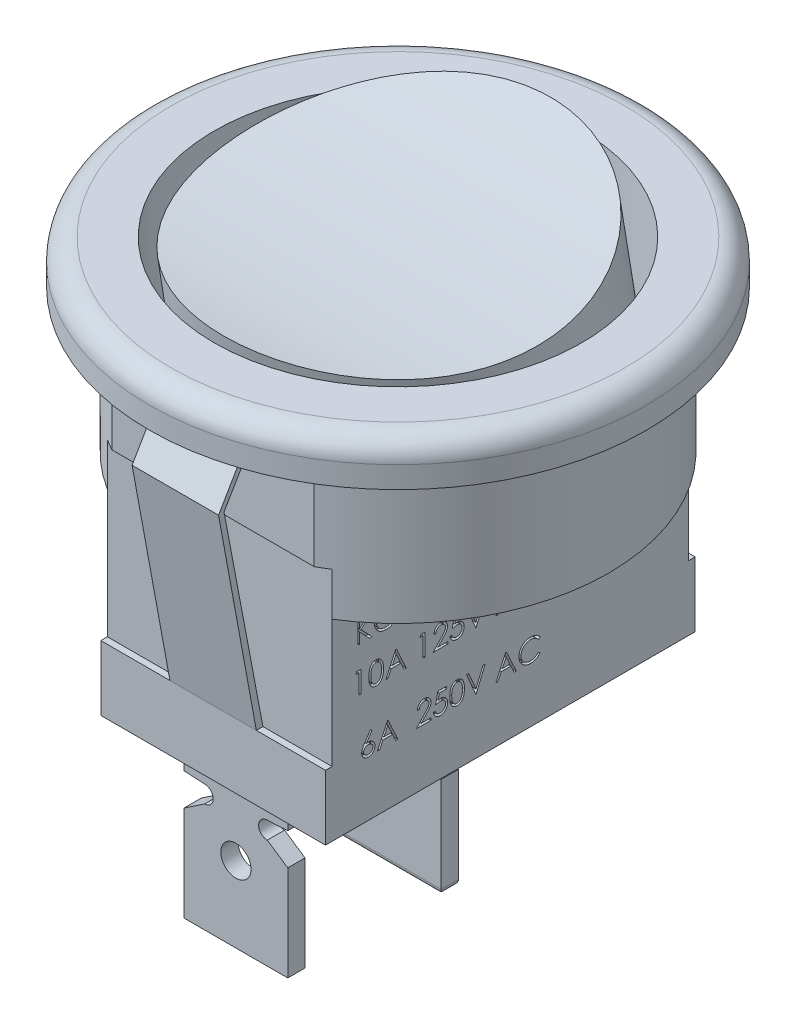
from build123d import *

# Parameters (mm, degrees)
SKETCH1_R                = 11.5
BOSS_EXTRUDE1_DEPTH      = 2
FILLET1_R                = 1
BOSS_EXTRUDE2_DEPTH      = 6.6
BOSS_EXTRUDE3_DEPTH      = 8.9
CUT_EXTRUDE1_START       = -2
CUT_EXTRUDE1_DEPTH       = 2
SKETCH5_W                = 4.8
SKETCH5_H                = 0.8
BOSS_EXTRUDE4_DEPTH      = 7.5
BOSS_EXTRUDE4_2_DEPTH    = 7.5
CUT_EXTRUDE2_START       = -7.9
SKETCH6_R                = 0.4
CUT_EXTRUDE2_DEPTH       = 7.9
CHAMFER1_SIZE            = 0.25
CUT_EXTRUDE3_START       = -4.6
CUT_EXTRUDE3_DEPTH       = 4.6
BOSS_EXTRUDE5_DEPTH      = 3
SKETCH10_R               = 8.5
CUT_EXTRUDE4_DEPTH       = 6
SKETCH11_R               = 0.74
CUT_EXTRUDE8_DEPTH       = 34.679556113
SKETCH14_R               = 7.625792812
BOSS_EXTRUDE6_DEPTH      = 6
CUT_EXTRUDE9_DEPTH       = 29.169132083
CUT_EXTRUDE9_DEPTH_BACK  = 29.169132083
SKETCH15_R               = 29.88062635
CUT_EXTRUDE10_DEPTH      = 0.2
FILLET2_R                = 0.25
CUT_EXTRUDE11_DEPTH      = 0.2
BOSS_EXTRUDE7_DEPTH      = 2
BOSS_EXTRUDE7_DEPTH_BACK = 2


with BuildPart() as part:
    # Sketch1 → Boss-Extrude1 (new body)
    with BuildSketch(Plane(origin=(0, 0, 0), x_dir=(1, 0, 0), z_dir=(0, 1, 0))):
        with Locations(Location((0, 0, 0), (0, 0, 270))):
            Circle(SKETCH1_R)
    extrude(amount=BOSS_EXTRUDE1_DEPTH)

    # Fillet1
    fillet1_edges = [part.edges().sort_by_distance(p)[0] for p in [
        (0, 2, -11.5),
    ]]
    fillet(fillet1_edges, radius=FILLET1_R)

    # Sketch2 → Boss-Extrude2 (add)
    with BuildSketch(Plane.XZ):
        with BuildLine():
            Line((-10.25, 0), (-10.25, -0.75))
            Line((-10.25, -0.75), (-9.721111048, -0.75))
            ThreePointArc((-9.721111048, -0.75), (9.75, 0), (-9.721111048, 0.75))
            Line((-9.721111048, 0.75), (-10.25, 0.75))
            Line((-10.25, 0.75), (-10.25, 0))
        make_face()
    extrude(amount=BOSS_EXTRUDE2_DEPTH)

    # Sketch3 → Boss-Extrude3 (add)
    with BuildSketch(Plane.XZ.offset(6.6)):
        Polygon((-5.2, 0), (-5.2, -8.25), (5.2, -8.25), (5.2, 0), (5.2, 8.25), (-5.2, 8.25), align=None)
    extrude(amount=BOSS_EXTRUDE3_DEPTH)

    # Sketch4 → Cut-Extrude1 (cut)
    with BuildSketch(Plane.XZ.offset(6.6).offset(CUT_EXTRUDE1_START)):
        with BuildLine():
            Line((-5.196152423, 8.25), (5.196152423, 8.25))
            ThreePointArc((5.196152423, 8.25), (0, 9.75), (-5.196152423, 8.25))
        make_face()
        with BuildLine():
            Line((5.196152423, -8.25), (-5.196152423, -8.25))
            ThreePointArc((-5.196152423, -8.25), (0, -9.75), (5.196152423, -8.25))
        make_face()
    extrude(amount=CUT_EXTRUDE1_DEPTH, mode=Mode.SUBTRACT)

    # Sketch7 → Cut-Extrude3 (cut)
    with BuildSketch(Plane.XZ.offset(4.6).offset(CUT_EXTRUDE3_START)):
        with BuildLine():
            Line((0, -8.554498889), (0, -9.75))
            ThreePointArc((0, -9.75), (2.414139167, -9.446397836), (4.677932103, -8.554498889))
            Line((4.677932103, -8.554498889), (0, -8.554498889))
        make_face()
        with BuildLine():
            ThreePointArc((-4.677932103, -8.554498889), (-2.414139167, -9.446397836), (0, -9.75))
            Line((0, -9.75), (0, -8.554498889))
            Line((0, -8.554498889), (-4.677932103, -8.554498889))
        make_face()
    cut_extrude3 = extrude(amount=CUT_EXTRUDE3_DEPTH, mode=Mode.SUBTRACT)

    # Mirror1: Cut-Extrude3 across plane
    add(cut_extrude3.mirror(Plane.XY), mode=Mode.SUBTRACT)

    # Sketch8 → Boss-Extrude5 (add)
    with BuildSketch(Plane.XZ.offset(15.5)):
        Polygon((-5.2, -8.25), (-5.2, -8.554498889), (-4.677932103, -8.554498889), (4.677932103, -8.554498889), (5.2, -8.554498889), (5.2, -8.25), align=None)
        Polygon((5.2, 8.25), (5.2, 8.554498889), (4.677932103, 8.554498889), (-4.677932103, 8.554498889), (-5.2, 8.554498889), (-5.2, 8.25), align=None)
    extrude(amount=-BOSS_EXTRUDE5_DEPTH)

    # Sketch10 → Cut-Extrude4 (cut)
    with BuildSketch(Plane(origin=(0, 2, 0), x_dir=(1, 0, 0), z_dir=(0, 1, 0))):
        with Locations(Location((0, 0, 0), (0, 0, 270))):
            Circle(SKETCH10_R)
    extrude(amount=-CUT_EXTRUDE4_DEPTH, mode=Mode.SUBTRACT)

    # Sketch11 → Cut-Extrude8 (cut, through all)
    with BuildSketch(Plane.ZY.offset(10.25)):
        with Locations((0, -0.74)):
            Circle(SKETCH11_R)
    extrude(amount=-CUT_EXTRUDE8_DEPTH, mode=Mode.SUBTRACT)

    # Sketch16 → Cut-Extrude10 (cut)
    # profile 1 of 4: a face of its own
    with BuildSketch(Plane(origin=(5.2, 0, 0), x_dir=(0, 0, -1), z_dir=(1, 0, 0))):
        Polygon((-7.060438689, -7.234147373), (-6.970695099, -7.234147373), (-6.970695099, -7.614956668), (-6.553828112, -7.234147373), (-6.425823304, -7.234147373), (-6.917209522, -7.682865322), (-6.387361766, -8.234147373), (-6.506953112, -8.234147373), (-6.970695099, -7.751575258), (-6.970695099, -8.234147373), (-7.060438689, -8.234147373), align=None)
    # profile 2 of 4: a face of its own
    with BuildSketch(Plane(origin=(5.2, 0, 0), x_dir=(0, 0, -1), z_dir=(1, 0, 0))):
        with BuildLine():
            Line((-5.316848945, -7.417640963), (-5.395374586, -7.477737117))
            add(Edge.make_bspline(
                [(-5.395374586, -7.477737117), (-5.400976269, -7.471061125), (-5.412104111, -7.457799149), (-5.43000674, -7.439176422), (-5.448664352, -7.421729205), (-5.468069815, -7.405374382), (-5.488572421, -7.390683878), (-5.509675506, -7.376892134), (-5.531732091, -7.364529923), (-5.562232586, -7.349540498), (-5.602131971, -7.33389874), (-5.652359068, -7.320783531), (-5.704790811, -7.312434624), (-5.740561553, -7.311530383), (-5.758755996, -7.31107045)],
                knots=[0, 0, 0, 0, 0.757959112, 1.505699292, 2.245454638, 2.979532153, 3.711538275, 4.438200793, 5.171680507, 5.909471876, 7.393775596, 8.890124382, 10.418191784, 12, 12, 12, 12], degree=3))
            add(Edge.make_bspline(
                [(-5.758755996, -7.31107045), (-5.768779796, -7.311185868), (-5.788734366, -7.311415632), (-5.818348215, -7.314446811), (-5.847409087, -7.318707157), (-5.875898077, -7.325028678), (-5.903778923, -7.333020855), (-5.931233895, -7.342570973), (-5.957865495, -7.354386641), (-5.984042134, -7.367446144), (-6.009121909, -7.382196843), (-6.032851922, -7.398286372), (-6.055145627, -7.415534685), (-6.076020659, -7.43400643), (-6.095498359, -7.453618418), (-6.113437591, -7.474579659), (-6.129776279, -7.496823137), (-6.144838286, -7.520055539), (-6.158327639, -7.544209194), (-6.16962189, -7.5693735), (-6.179623354, -7.595117529), (-6.187537423, -7.621732147), (-6.193801571, -7.64903008), (-6.19812376, -7.677084591), (-6.201120466, -7.70583707), (-6.201349088, -7.725325446), (-6.20146433, -7.735148976)],
                knots=[0, 0, 0, 0, 1.054917814, 2.100044995, 3.131103042, 4.146048494, 5.169673617, 6.183595914, 7.203665975, 8.234915748, 9.262203917, 10.264457458, 11.251630812, 12.227803204, 13.197192746, 14.159520551, 15.12972552, 16.100847026, 17.073214652, 18.039054194, 19.002613845, 19.979014051, 20.95965708, 21.949030935, 22.966165397, 24, 24, 24, 24], degree=3))
            add(Edge.make_bspline(
                [(-6.20146433, -7.735148976), (-6.20110381, -7.749929353), (-6.200395977, -7.778948663), (-6.194096453, -7.821454551), (-6.18452357, -7.862174744), (-6.170176263, -7.900854699), (-6.152485105, -7.937971373), (-6.130130645, -7.972896759), (-6.104240206, -8.006158635), (-6.074447514, -8.036970906), (-6.041760138, -8.065117684), (-6.006689306, -8.089903565), (-5.969322367, -8.11056496), (-5.930071901, -8.127758087), (-5.888635869, -8.140974295), (-5.845088782, -8.150278331), (-5.799525355, -8.156347525), (-5.768391241, -8.156928579), (-5.752546061, -8.157224296)],
                knots=[0, 0, 0, 0, 1.029171465, 2.020641659, 2.987623507, 3.938342917, 4.889210282, 5.84687017, 6.821220943, 7.821438502, 8.827599549, 9.822697543, 10.807740252, 11.797342354, 12.80366471, 13.83203677, 14.896651826, 16, 16, 16, 16], degree=3))
            add(Edge.make_bspline(
                [(-5.752546061, -8.157224296), (-5.735088149, -8.156741788), (-5.700726804, -8.155792096), (-5.650335939, -8.147746596), (-5.602097149, -8.134701476), (-5.556007839, -8.116444927), (-5.51219794, -8.092711988), (-5.470598894, -8.063941166), (-5.431175588, -8.029858785), (-5.407469508, -8.003835034), (-5.395374586, -7.99055763)],
                knots=[0, 0, 0, 0, 1.028121516, 2.023589091, 2.998037872, 3.967518031, 4.937445131, 5.927275754, 6.942489185, 8, 8, 8, 8], degree=3))
            Line((-5.395374586, -7.99055763), (-5.316848945, -8.050052822))
            add(Edge.make_bspline(
                [(-5.316848945, -8.050052822), (-5.323168405, -8.058206665), (-5.335777055, -8.074475296), (-5.356193632, -8.09741007), (-5.377701431, -8.118982651), (-5.400460205, -8.139019115), (-5.424208146, -8.15792039), (-5.449371663, -8.175149485), (-5.475619958, -8.190946881), (-5.502864095, -8.205411716), (-5.531075127, -8.218245215), (-5.560219252, -8.229232006), (-5.590170845, -8.23869626), (-5.620931276, -8.246482528), (-5.652564349, -8.25255998), (-5.684955913, -8.256622745), (-5.718175877, -8.259406149), (-5.740587712, -8.259659839), (-5.751945099, -8.259788399)],
                knots=[0, 0, 0, 0, 0.986787822, 1.968848986, 2.935600012, 3.899624008, 4.868462664, 5.837806735, 6.815139263, 7.798259679, 8.787526145, 9.778297419, 10.776456485, 11.791383307, 12.812564526, 13.85620153, 14.913611965, 16, 16, 16, 16], degree=3))
            add(Edge.make_bspline(
                [(-5.751945099, -8.259788399), (-5.762700432, -8.259713544), (-5.783967773, -8.259565527), (-5.815367416, -8.257167765), (-5.845935867, -8.253896412), (-5.875585761, -8.24897066), (-5.904478896, -8.243157991), (-5.932353349, -8.235366204), (-5.959483409, -8.22663787), (-5.985760078, -8.216379303), (-6.011205706, -8.204803251), (-6.035738224, -8.191719948), (-6.059346348, -8.177239415), (-6.082262182, -8.161680841), (-6.104147206, -8.144544469), (-6.12519107, -8.126068288), (-6.145511778, -8.10631457), (-6.158083974, -8.092070327), (-6.164405035, -8.084908591)],
                knots=[0, 0, 0, 0, 1.114604814, 2.203992996, 3.262667896, 4.300477797, 5.318619304, 6.316056647, 7.298880507, 8.271930387, 9.238335007, 10.195173496, 11.151986948, 12.108099108, 13.064862484, 14.031167946, 15.010108607, 16, 16, 16, 16], degree=3))
            add(Edge.make_bspline(
                [(-6.164405035, -8.084908591), (-6.174529505, -8.072468251), (-6.194656212, -8.047737763), (-6.220406407, -8.007656054), (-6.242448566, -7.965807994), (-6.260270258, -7.921973729), (-6.274202467, -7.876251618), (-6.283854237, -7.828618614), (-6.290126124, -7.779119202), (-6.29084335, -7.745451548), (-6.29120792, -7.728338078)],
                knots=[0, 0, 0, 0, 0.994628077, 1.977248131, 2.950237994, 3.925870899, 4.908910175, 5.911660606, 6.938484602, 8, 8, 8, 8], degree=3))
            add(Edge.make_bspline(
                [(-6.29120792, -7.728338078), (-6.290763579, -7.710350806), (-6.289889365, -7.67496197), (-6.282461995, -7.623026555), (-6.270513768, -7.573269012), (-6.253543228, -7.525782228), (-6.232027413, -7.480316434), (-6.205448381, -7.437218947), (-6.174114912, -7.396214147), (-6.13827275, -7.357924218), (-6.098967797, -7.322912974), (-6.056876707, -7.292111202), (-6.012081865, -7.266477626), (-5.965076764, -7.245050151), (-5.915509427, -7.228580304), (-5.863485607, -7.217050822), (-5.80910306, -7.209874503), (-5.77199951, -7.208967301), (-5.753147022, -7.208506347)],
                knots=[0, 0, 0, 0, 1.032925535, 2.032216505, 3.007276963, 3.968222605, 4.92396291, 5.891752235, 6.871517503, 7.883894988, 8.900124299, 9.891468569, 10.874487609, 11.85992873, 12.854644235, 13.869047385, 14.917252991, 16, 16, 16, 16], degree=3))
            add(Edge.make_bspline(
                [(-5.753147022, -7.208506347), (-5.741657173, -7.208644101), (-5.718914174, -7.208916771), (-5.685270559, -7.211575669), (-5.652515608, -7.216008128), (-5.620626756, -7.22204129), (-5.589448866, -7.229529097), (-5.559220226, -7.239283467), (-5.529763458, -7.250436762), (-5.501264341, -7.263282038), (-5.473859613, -7.277701107), (-5.447557807, -7.293534142), (-5.422567848, -7.310761515), (-5.398713891, -7.329236708), (-5.376394974, -7.349350582), (-5.354977408, -7.370549896), (-5.335188529, -7.393445274), (-5.32297333, -7.409560969), (-5.316848945, -7.417640963)],
                knots=[0, 0, 0, 0, 1.096760587, 2.17092713, 3.219439832, 4.250915756, 5.268269357, 6.278326846, 7.281116186, 8.274029601, 9.260640565, 10.235837813, 11.203064059, 12.156899882, 13.114053108, 14.069676657, 15.032185724, 16, 16, 16, 16], degree=3))
        make_face()
    # profile 3 of 4: a face of its own
    with BuildSketch(Plane(origin=(5.2, 0, 0), x_dir=(0, 0, -1), z_dir=(1, 0, 0))):
        with BuildLine():
            Line((-5.11172074, -8.234147373), (-5.11172074, -7.234147373))
            Line((-5.11172074, -7.234147373), (-4.909797663, -7.234147373))
            add(Edge.make_bspline(
                [(-4.909797663, -7.234147373), (-4.892235095, -7.234273822), (-4.858304305, -7.23451812), (-4.809272177, -7.236067089), (-4.763905388, -7.238807222), (-4.722353142, -7.242798515), (-4.684501368, -7.247699382), (-4.650456051, -7.253842354), (-4.620041153, -7.261096117), (-4.601335599, -7.267280532), (-4.592489971, -7.270205065)],
                knots=[0, 0, 0, 0, 1.314313732, 2.53924729, 3.670748893, 4.714932338, 5.66265055, 6.526160246, 7.303039223, 8, 8, 8, 8], degree=3))
            add(Edge.make_bspline(
                [(-4.592489971, -7.270205065), (-4.580920045, -7.274613838), (-4.558042562, -7.283331408), (-4.525469098, -7.299776066), (-4.494804709, -7.31840838), (-4.465884953, -7.339252913), (-4.439370431, -7.362899869), (-4.414225318, -7.388344751), (-4.391478254, -7.416512848), (-4.370647312, -7.446819988), (-4.351865695, -7.478909145), (-4.335540222, -7.512719176), (-4.321981938, -7.548078379), (-4.31072673, -7.584888421), (-4.301856314, -7.623230243), (-4.295804333, -7.663148491), (-4.291812622, -7.704485402), (-4.291411464, -7.732535249), (-4.29120792, -7.746767565)],
                knots=[0, 0, 0, 0, 0.984719456, 1.947108742, 2.898477687, 3.838006223, 4.779231079, 5.722358779, 6.681677486, 7.655904652, 8.64651281, 9.637519902, 10.640069247, 11.656948941, 12.698408672, 13.768548281, 14.867775369, 16, 16, 16, 16], degree=3))
            add(Edge.make_bspline(
                [(-4.29120792, -7.746767565), (-4.291387625, -7.759127919), (-4.291741752, -7.783485288), (-4.294921557, -7.819382686), (-4.299543362, -7.854215135), (-4.306698847, -7.887816764), (-4.31538528, -7.920481969), (-4.326517894, -7.95186261), (-4.339270893, -7.982246556), (-4.354142287, -8.011222977), (-4.370468397, -8.038675369), (-4.387988895, -8.064554092), (-4.406685094, -8.088489869), (-4.426735275, -8.110555187), (-4.447880337, -8.130716781), (-4.470258717, -8.149143071), (-4.49392816, -8.165473515), (-4.518782652, -8.180349832), (-4.54554726, -8.193327076), (-4.574728936, -8.204307079), (-4.60645213, -8.213406112), (-4.640638975, -8.220997797), (-4.67734854, -8.227019883), (-4.716616816, -8.231055995), (-4.75838347, -8.233785405), (-4.78706326, -8.234024374), (-4.801824907, -8.234147373)],
                knots=[0, 0, 0, 0, 1.105936401, 2.179363191, 3.223086493, 4.248585256, 5.251745608, 6.245858792, 7.225916811, 8.198733463, 9.158002045, 10.082870192, 10.993790845, 11.873723703, 12.748670949, 13.606408763, 14.465103618, 15.319838547, 16.196477973, 17.123216899, 18.106603292, 19.147568657, 20.255746949, 21.433717677, 22.679120308, 24, 24, 24, 24], degree=3))
            Line((-4.801824907, -8.234147373), (-5.11172074, -8.234147373))
        make_face()
        with BuildLine():
            Line((-5.02197715, -8.131583271), (-4.907193496, -8.131583271))
            add(Edge.make_bspline(
                [(-4.907193496, -8.131583271), (-4.890699676, -8.131512386), (-4.85897602, -8.131376049), (-4.813359449, -8.130179705), (-4.771679621, -8.128224866), (-4.733930619, -8.125489129), (-4.700133755, -8.121869525), (-4.670218397, -8.117833838), (-4.644282609, -8.112805995), (-4.628588485, -8.108248578), (-4.621336125, -8.106142565)],
                knots=[0, 0, 0, 0, 1.375205317, 2.645023457, 3.804390687, 4.853969522, 5.800190428, 6.637939096, 7.370582563, 8, 8, 8, 8], degree=3))
            add(Edge.make_bspline(
                [(-4.621336125, -8.106142565), (-4.612208021, -8.102927834), (-4.594169839, -8.096575156), (-4.568203815, -8.084987253), (-4.543987528, -8.071260948), (-4.521098949, -8.056003155), (-4.499862762, -8.038675726), (-4.4800273, -8.019655443), (-4.461632499, -7.998845508), (-4.444868411, -7.976271747), (-4.429866039, -7.952074663), (-4.416874259, -7.926492139), (-4.405488107, -7.899804479), (-4.396551366, -7.871601862), (-4.389546914, -7.842136417), (-4.384585574, -7.81140607), (-4.381495653, -7.779416561), (-4.381135239, -7.757658811), (-4.380951509, -7.746567245)],
                knots=[0, 0, 0, 0, 0.998632004, 1.973411704, 2.929992603, 3.868527914, 4.809262121, 5.754881198, 6.702106254, 7.672490631, 8.653608572, 9.636854334, 10.631411391, 11.644891563, 12.686317036, 13.754757253, 14.855430412, 16, 16, 16, 16], degree=3))
            add(Edge.make_bspline(
                [(-4.380951509, -7.746567245), (-4.381098163, -7.734871965), (-4.381386265, -7.711896484), (-4.385007497, -7.678184856), (-4.39029937, -7.645761813), (-4.397951851, -7.614625186), (-4.407703531, -7.584714228), (-4.419873429, -7.556194368), (-4.433778177, -7.528764406), (-4.450321987, -7.503057444), (-4.468440728, -7.478745127), (-4.488548694, -7.456472294), (-4.510326419, -7.436188208), (-4.533536376, -7.417576976), (-4.55883269, -7.401387354), (-4.585619459, -7.386905446), (-4.614289651, -7.374615191), (-4.634236135, -7.368078373), (-4.644372984, -7.364756347)],
                knots=[0, 0, 0, 0, 1.122418816, 2.205001699, 3.251619955, 4.274784885, 5.280384055, 6.268708349, 7.249350384, 8.229342522, 9.199999885, 10.157847722, 11.105861043, 12.055065948, 13.010012805, 13.98527497, 14.976112212, 16, 16, 16, 16], degree=3))
            add(Edge.make_bspline(
                [(-4.644372984, -7.364756347), (-4.652759025, -7.362437368), (-4.670590051, -7.357506582), (-4.699687041, -7.352127904), (-4.732434227, -7.347383761), (-4.768976998, -7.343367179), (-4.809273701, -7.340485087), (-4.853355326, -7.338321854), (-4.901240927, -7.336862816), (-4.934435937, -7.336763185), (-4.95166465, -7.336711476)],
                knots=[0, 0, 0, 0, 0.674548936, 1.434276114, 2.292660221, 3.240891867, 4.284742987, 5.42552168, 6.663806718, 8, 8, 8, 8], degree=3))
            Line((-4.95166465, -7.336711476), (-5.02197715, -7.336711476))
            Line((-5.02197715, -7.336711476), (-5.02197715, -8.131583271))
        make_face(mode=Mode.SUBTRACT)
    # profile 4 of 4: a face of its own
    with BuildSketch(Plane(origin=(5.2, 0, 0), x_dir=(0, 0, -1), z_dir=(1, 0, 0))):
        Polygon((-3.96328324, -7.234147373), (-3.778387407, -7.234147373), (-3.778387407, -8.234147373), (-3.868130996, -8.234147373), (-3.868130996, -7.336711476), (-4.02197715, -7.336711476), align=None)
    extrude(amount=-CUT_EXTRUDE10_DEPTH, mode=Mode.SUBTRACT)

    # Sketch17 → Cut-Extrude11 (cut)
    # profile 1 of 17: a face of its own
    with BuildSketch(Plane(origin=(5.2, 0, 0), x_dir=(0, 0, -1), z_dir=(1, 0, 0))):
        Polygon((-7.105994989, -9.26702292), (-6.921099156, -9.26702292), (-6.921099156, -10.26702292), (-7.010842746, -10.26702292), (-7.010842746, -9.369587023), (-7.1646889, -9.369587023), align=None)
    # profile 2 of 17: a face of its own
    with BuildSketch(Plane(origin=(5.2, 0, 0), x_dir=(0, 0, -1), z_dir=(1, 0, 0))):
        with BuildLine():
            add(Edge.make_bspline(
                [(-6.549304284, -9.767423561), (-6.549210565, -9.751395736), (-6.549028513, -9.720261455), (-6.54700325, -9.674894414), (-6.543638867, -9.632334332), (-6.539028189, -9.59257917), (-6.533417337, -9.555618666), (-6.525927198, -9.521551592), (-6.517409254, -9.490220276), (-6.507537127, -9.461522548), (-6.496397759, -9.435071776), (-6.484273684, -9.410378861), (-6.470683743, -9.387481166), (-6.456404625, -9.366013226), (-6.440858319, -9.346326456), (-6.424487236, -9.328142838), (-6.406652414, -9.311882624), (-6.387960126, -9.297069395), (-6.368241136, -9.284083831), (-6.348057517, -9.272645906), (-6.327270344, -9.262874515), (-6.305822863, -9.255191534), (-6.283907847, -9.248845577), (-6.261448685, -9.244505878), (-6.238408295, -9.241775333), (-6.222856457, -9.241514285), (-6.214969348, -9.241381894)],
                knots=[0, 0, 0, 0, 1.646270934, 3.197905019, 4.663502075, 6.030701355, 7.308322542, 8.50163776, 9.611534131, 10.641858119, 11.616356847, 12.558055219, 13.465016945, 14.349605745, 15.204443733, 16.039544428, 16.859896111, 17.680448484, 18.487036065, 19.28249412, 20.06191084, 20.843045899, 21.620316918, 22.403196591, 23.190181807, 24, 24, 24, 24], degree=3))
            add(Edge.make_bspline(
                [(-6.214969348, -9.241381894), (-6.207016354, -9.24152127), (-6.191200352, -9.241798445), (-6.167817387, -9.244462428), (-6.144974621, -9.248882749), (-6.122769439, -9.255145885), (-6.101019443, -9.262916078), (-6.079894755, -9.272655254), (-6.05926416, -9.283992074), (-6.039455506, -9.297313181), (-6.020251331, -9.31216526), (-6.002123341, -9.328954594), (-5.985069888, -9.347511657), (-5.968876944, -9.367637904), (-5.954003916, -9.389719357), (-5.939840078, -9.413371959), (-5.927162354, -9.439009349), (-5.914952446, -9.466203769), (-5.904413307, -9.495707671), (-5.894908666, -9.527354746), (-5.88722896, -9.561518799), (-5.880832026, -9.598020583), (-5.875876341, -9.63699415), (-5.872267015, -9.678355955), (-5.870360419, -9.722133209), (-5.870001361, -9.752064023), (-5.869817105, -9.767423561)],
                knots=[0, 0, 0, 0, 0.810914788, 1.612654377, 2.396697861, 3.181598691, 3.963628158, 4.749916497, 5.551656086, 6.361998678, 7.18212741, 8.025565596, 8.878627764, 9.750805457, 10.657531673, 11.591944965, 12.560506719, 13.57287815, 14.630710178, 15.753379473, 16.941251878, 18.199788006, 19.531962791, 20.947069417, 22.433333509, 24, 24, 24, 24], degree=3))
            add(Edge.make_bspline(
                [(-5.869817105, -9.767423561), (-5.870003272, -9.782716106), (-5.87036601, -9.812513007), (-5.872245641, -9.856093285), (-5.875948107, -9.897235584), (-5.880579532, -9.936038573), (-5.886994093, -9.97234075), (-5.894881283, -10.006267735), (-5.903638519, -10.037966041), (-5.91444846, -10.067175987), (-5.926280091, -10.094305051), (-5.939153004, -10.119638522), (-5.952944383, -10.14340032), (-5.967969739, -10.165400247), (-5.983985, -10.185794149), (-6.00133294, -10.204222042), (-6.019524535, -10.221127948), (-6.038785226, -10.23617127), (-6.058902812, -10.249338357), (-6.079462548, -10.261113743), (-6.100829229, -10.270608799), (-6.122518644, -10.278761668), (-6.144841034, -10.284990368), (-6.167768574, -10.289297184), (-6.191184642, -10.292317712), (-6.20701366, -10.292548135), (-6.214969348, -10.292663946)],
                knots=[0, 0, 0, 0, 1.561518951, 3.042555995, 4.452378317, 5.7783523, 7.031515105, 8.214008947, 9.334062868, 10.386615937, 11.391082383, 12.354592575, 13.286541444, 14.194233754, 15.072674879, 15.931287219, 16.775624067, 17.606195743, 18.42308326, 19.229000347, 20.022332153, 20.807536673, 21.593273796, 22.3848459, 23.188221202, 24, 24, 24, 24], degree=3))
            add(Edge.make_bspline(
                [(-6.214969348, -10.292663946), (-6.222856238, -10.292530701), (-6.238407645, -10.292267969), (-6.261451195, -10.28954976), (-6.283817608, -10.285179617), (-6.305617252, -10.279060587), (-6.32696197, -10.271570634), (-6.347560909, -10.261812438), (-6.367643105, -10.250574133), (-6.387154978, -10.237775441), (-6.405729881, -10.223112103), (-6.423472339, -10.206893735), (-6.439936631, -10.188715617), (-6.455260658, -10.168864782), (-6.469824683, -10.147523856), (-6.483221647, -10.124401463), (-6.49561332, -10.099589289), (-6.506940031, -10.072927029), (-6.516982506, -10.044025621), (-6.52585328, -10.012554427), (-6.532857325, -9.978235674), (-6.538852455, -9.941344997), (-6.543687993, -9.901723875), (-6.546989229, -9.859350795), (-6.549029605, -9.814252164), (-6.549211054, -9.783317943), (-6.549304284, -9.767423561)],
                knots=[0, 0, 0, 0, 0.810891512, 1.598919785, 2.382837074, 3.152667961, 3.926044502, 4.706494248, 5.493654104, 6.291793342, 7.103789334, 7.925228297, 8.761435821, 9.622817696, 10.50288917, 11.416980706, 12.369136599, 13.353924996, 14.394355917, 15.514179734, 16.714354668, 17.994756427, 19.357759367, 20.818452758, 22.365282078, 24, 24, 24, 24], degree=3))
        make_face()
        with BuildLine():
            add(Edge.make_bspline(
                [(-6.459560694, -9.76702292), (-6.459526567, -9.780379691), (-6.459460331, -9.806302561), (-6.457729988, -9.843972064), (-6.455372779, -9.879106444), (-6.452332409, -9.911750311), (-6.44781728, -9.941793172), (-6.442758198, -9.969441653), (-6.436601601, -9.994549435), (-6.42931731, -10.01728881), (-6.421020426, -10.038045686), (-6.411961607, -10.057360319), (-6.402229972, -10.075460872), (-6.391338786, -10.092184761), (-6.37947734, -10.107586522), (-6.366913551, -10.12193876), (-6.353178527, -10.134737897), (-6.334177458, -10.150088427), (-6.309092751, -10.165951037), (-6.277486907, -10.179764205), (-6.245010206, -10.188444907), (-6.222966992, -10.189548837), (-6.211964541, -10.190099843)],
                knots=[0, 0, 0, 0, 1.459021318, 2.831673884, 4.118529203, 5.306027144, 6.411944654, 7.436330062, 8.375795394, 9.233974572, 10.042671642, 10.816086306, 11.563610507, 12.285937304, 12.993564865, 13.685989202, 14.367179055, 15.041617293, 16.353048772, 17.594441528, 18.799311195, 20, 20, 20, 20], degree=3))
            add(Edge.make_bspline(
                [(-6.211964541, -10.190099843), (-6.20089092, -10.189643334), (-6.178766542, -10.188731259), (-6.146442601, -10.17993162), (-6.115062523, -10.166654609), (-6.09047054, -10.150955321), (-6.071761242, -10.13600437), (-6.058356388, -10.123257328), (-6.046052946, -10.108984223), (-6.034383781, -10.093584424), (-6.023681188, -10.076763714), (-6.013948863, -10.058602978), (-6.005067907, -10.039051785), (-6.000008179, -10.025403288), (-5.997421271, -10.018425164)],
                knots=[0, 0, 0, 0, 1.353760809, 2.704726607, 4.075137775, 5.516104923, 6.260822281, 7.007110065, 7.778089737, 8.566572457, 9.372053459, 10.217411131, 11.088608312, 12, 12, 12, 12], degree=3))
            add(Edge.make_bspline(
                [(-5.997421271, -10.018425164), (-5.99440648, -10.009502381), (-5.988285162, -9.991385305), (-5.980396084, -9.963281405), (-5.974183113, -9.933794901), (-5.96859358, -9.90310201), (-5.964778421, -9.870976382), (-5.961707617, -9.837517415), (-5.959898849, -9.802699883), (-5.959674635, -9.779044171), (-5.959560694, -9.76702292)],
                knots=[0, 0, 0, 0, 0.884706709, 1.796334032, 2.740027952, 3.714592787, 4.726048262, 5.777819803, 6.87074269, 8, 8, 8, 8], degree=3))
            add(Edge.make_bspline(
                [(-5.959560694, -9.76702292), (-5.959717891, -9.755003614), (-5.960025402, -9.731491281), (-5.961200827, -9.697057515), (-5.964236134, -9.66435244), (-5.967607311, -9.633235162), (-5.972577946, -9.603877933), (-5.977937319, -9.576034989), (-5.985137665, -9.550051267), (-5.99282903, -9.525519958), (-6.001632, -9.502719771), (-6.01132221, -9.481544404), (-6.021671283, -9.461891625), (-6.032911924, -9.443815356), (-6.04491069, -9.42723463), (-6.057984276, -9.412481888), (-6.071614096, -9.399099898), (-6.090704721, -9.383824878), (-6.115697375, -9.368250108), (-6.146796132, -9.353917033), (-6.179159173, -9.345686093), (-6.201037303, -9.344525611), (-6.211964541, -9.343945997)],
                knots=[0, 0, 0, 0, 1.31362396, 2.569729283, 3.763502607, 4.902122613, 5.988968491, 7.01645872, 7.998833611, 8.933434873, 9.825090667, 10.667526885, 11.477055099, 12.250526234, 12.991942729, 13.710640831, 14.402115721, 15.076753259, 16.378508321, 17.609869233, 18.806226677, 20, 20, 20, 20], degree=3))
            add(Edge.make_bspline(
                [(-6.211964541, -9.343945997), (-6.22302471, -9.34452641), (-6.245165197, -9.345688294), (-6.277864613, -9.353886367), (-6.309208713, -9.368175786), (-6.334135277, -9.383876463), (-6.353239216, -9.398830267), (-6.366691414, -9.411797825), (-6.379304606, -9.425982469), (-6.390923949, -9.441525873), (-6.401806602, -9.458230264), (-6.411801177, -9.476227054), (-6.420806128, -9.495607444), (-6.429115996, -9.516354997), (-6.436422506, -9.539092409), (-6.442449353, -9.564169265), (-6.448017083, -9.591729805), (-6.451958588, -9.621935379), (-6.455462518, -9.654587423), (-6.457714332, -9.689809514), (-6.45946612, -9.727542194), (-6.459528538, -9.753599096), (-6.459560694, -9.76702292)],
                knots=[0, 0, 0, 0, 1.207732386, 2.417664972, 3.655092373, 4.956220595, 5.625982001, 6.301752483, 6.994047911, 7.697131622, 8.419323945, 9.170223765, 9.943494443, 10.752040957, 11.610060368, 12.549350801, 13.567764191, 14.679664412, 15.874934091, 17.154273443, 18.533957287, 20, 20, 20, 20], degree=3))
        make_face(mode=Mode.SUBTRACT)
    # profile 3 of 17: a face of its own
    with BuildSketch(Plane(origin=(5.2, 0, 0), x_dir=(0, 0, -1), z_dir=(1, 0, 0))):
        Polygon((-5.280073515, -9.26702292), (-4.818535053, -10.26702292), (-4.916091143, -10.26702292), (-5.063927682, -9.9465101), (-5.517253002, -9.9465101), (-5.669296271, -10.26702292), (-5.767253002, -10.26702292), (-5.292894028, -9.26702292), align=None)
        Polygon((-5.287485374, -9.461934779), (-5.468575117, -9.843945997), (-5.111203323, -9.843945997), align=None, mode=Mode.SUBTRACT)
    # profile 4 of 17: a face of its own
    with BuildSketch(Plane(origin=(5.2, 0, 0), x_dir=(0, 0, -1), z_dir=(1, 0, 0))):
        Polygon((-4.131636015, -9.26702292), (-3.946740182, -9.26702292), (-3.946740182, -10.26702292), (-4.036483771, -10.26702292), (-4.036483771, -9.369587023), (-4.190329925, -9.369587023), align=None)
    # profile 5 of 17: a face of its own
    with BuildSketch(Plane(origin=(5.2, 0, 0), x_dir=(0, 0, -1), z_dir=(1, 0, 0))):
        with BuildLine():
            Line((-3.446740182, -9.574715228), (-3.536483771, -9.574715228))
            add(Edge.make_bspline(
                [(-3.536483771, -9.574715228), (-3.53589887, -9.56280926), (-3.534750141, -9.539426256), (-3.529370629, -9.505333711), (-3.521673236, -9.472746626), (-3.510789963, -9.44192665), (-3.497273884, -9.412601277), (-3.481065305, -9.384886987), (-3.461867062, -9.358889504), (-3.440093709, -9.334849835), (-3.416445527, -9.312796243), (-3.390929544, -9.293751888), (-3.364116679, -9.277661125), (-3.336088279, -9.264209341), (-3.306528118, -9.254112242), (-3.275704445, -9.246620345), (-3.243481834, -9.242112818), (-3.221527542, -9.241628308), (-3.210361976, -9.241381894)],
                knots=[0, 0, 0, 0, 1.10065271, 2.161652631, 3.183658789, 4.190468796, 5.17591951, 6.163126047, 7.15150782, 8.156236427, 9.156009102, 10.134482811, 11.092018607, 12.041330605, 13.001268258, 13.972401359, 14.968799086, 16, 16, 16, 16], degree=3))
            add(Edge.make_bspline(
                [(-3.210361976, -9.241381894), (-3.199396812, -9.241638596), (-3.177850657, -9.242143006), (-3.146404367, -9.246474729), (-3.116467997, -9.253259184), (-3.088100064, -9.262777874), (-3.061526902, -9.275573425), (-3.03654889, -9.29094415), (-3.012868658, -9.308721245), (-2.991552434, -9.329650906), (-2.971978697, -9.351994444), (-2.955092339, -9.375848131), (-2.940631435, -9.40048507), (-2.928577812, -9.426093127), (-2.919704629, -9.452913421), (-2.912967999, -9.480555479), (-2.909160166, -9.509305425), (-2.908575759, -9.528764441), (-2.908278643, -9.538657535)],
                knots=[0, 0, 0, 0, 1.111607364, 2.184268762, 3.212621178, 4.221274766, 5.211760367, 6.196651075, 7.1921475, 8.207485113, 9.220403448, 10.201281604, 11.166441695, 12.114753415, 13.065576456, 14.026450734, 14.996634279, 16, 16, 16, 16], degree=3))
            add(Edge.make_bspline(
                [(-2.908278643, -9.538657535), (-2.908762432, -9.552585488), (-2.909721521, -9.580196978), (-2.917925629, -9.620772653), (-2.930738918, -9.660085058), (-2.946166734, -9.691724288), (-2.96173029, -9.717219571), (-2.975755292, -9.73821063), (-2.992173809, -9.760812192), (-3.011224809, -9.784948574), (-3.032514201, -9.810808833), (-3.056234819, -9.838377346), (-3.082555814, -9.86736928), (-3.101029671, -9.887170881), (-3.110602361, -9.897431574)],
                knots=[0, 0, 0, 0, 1.184426356, 2.348067706, 3.509069118, 4.696110526, 5.333549288, 6.050745305, 6.844228056, 7.710549037, 8.667450064, 9.695053472, 10.805634456, 12, 12, 12, 12], degree=3))
            Line((-3.110602361, -9.897431574), (-3.360802682, -10.164458818))
            Line((-3.360802682, -10.164458818), (-2.89545813, -10.164458818))
            Line((-2.89545813, -10.164458818), (-2.89545813, -10.26702292))
            Line((-2.89545813, -10.26702292), (-3.57494531, -10.26702292))
            Line((-3.57494531, -10.26702292), (-3.187124797, -9.853160741))
            add(Edge.make_bspline(
                [(-3.187124797, -9.853160741), (-3.177682544, -9.843304082), (-3.159545907, -9.824371457), (-3.133893742, -9.796730611), (-3.110854031, -9.771087885), (-3.090277634, -9.747491728), (-3.072610918, -9.725596995), (-3.056933137, -9.706112794), (-3.04437154, -9.688182951), (-3.03073857, -9.667399918), (-3.017534575, -9.642024971), (-3.006188187, -9.611015345), (-2.999269659, -9.579093273), (-2.998439706, -9.557521262), (-2.998022233, -9.546670356)],
                knots=[0, 0, 0, 0, 1.329631726, 2.553950428, 3.673215718, 4.687767853, 5.603093632, 6.413772471, 7.123043292, 7.734684054, 8.834405432, 9.900288307, 10.943827018, 12, 12, 12, 12], degree=3))
            add(Edge.make_bspline(
                [(-2.998022233, -9.546670356), (-2.998203873, -9.539847099), (-2.998561852, -9.526399771), (-3.001721194, -9.506683839), (-3.006495625, -9.487665321), (-3.013337127, -9.469285716), (-3.022367624, -9.451729815), (-3.033360019, -9.434976249), (-3.046042894, -9.418779402), (-3.060714685, -9.403592746), (-3.076832262, -9.38968383), (-3.093859191, -9.377362663), (-3.111873506, -9.367065774), (-3.130799255, -9.358624775), (-3.150583675, -9.352003237), (-3.171265031, -9.347415071), (-3.192786178, -9.344534362), (-3.207481463, -9.344144598), (-3.214969348, -9.343945997)],
                knots=[0, 0, 0, 0, 0.991446411, 1.95395049, 2.89581595, 3.838931463, 4.798493298, 5.75982156, 6.748411868, 7.785213223, 8.824556874, 9.840280684, 10.836137867, 11.835679398, 12.848801643, 13.863922112, 14.911575587, 16, 16, 16, 16], degree=3))
            add(Edge.make_bspline(
                [(-3.214969348, -9.343945997), (-3.222789586, -9.344150292), (-3.238147242, -9.344551493), (-3.260695537, -9.347357969), (-3.282205759, -9.352199638), (-3.302732017, -9.358821545), (-3.322309042, -9.367238273), (-3.340841626, -9.377721628), (-3.358288166, -9.390231198), (-3.374681458, -9.404414214), (-3.389785452, -9.420204957), (-3.403055988, -9.437807804), (-3.414651421, -9.456901351), (-3.424768345, -9.47743408), (-3.432984256, -9.499592303), (-3.439262299, -9.523297361), (-3.44422997, -9.548446327), (-3.445889547, -9.565813494), (-3.446740182, -9.574715228)],
                knots=[0, 0, 0, 0, 1.031018746, 2.02475058, 2.990194455, 3.934040569, 4.864654155, 5.795059489, 6.735614925, 7.690564532, 8.649604399, 9.611025574, 10.590972636, 11.591080095, 12.624614302, 13.701020113, 14.821632451, 16, 16, 16, 16], degree=3))
        make_face()
    # profile 6 of 17: a face of its own
    with BuildSketch(Plane(origin=(5.2, 0, 0), x_dir=(0, 0, -1), z_dir=(1, 0, 0))):
        with BuildLine():
            Line((-2.177509412, -9.26702292), (-2.177509412, -9.369587023))
            Line((-2.177509412, -9.369587023), (-2.517653643, -9.369587023))
            Line((-2.517653643, -9.369587023), (-2.571539861, -9.632607856))
            add(Edge.make_bspline(
                [(-2.571539861, -9.632607856), (-2.560952468, -9.629684921), (-2.54044107, -9.624022197), (-2.510166824, -9.617734834), (-2.481426194, -9.613944707), (-2.462776088, -9.61342719), (-2.4537514, -9.613176766)],
                knots=[0, 0, 0, 0, 1.100273476, 2.13160584, 3.095893838, 4, 4, 4, 4], degree=3))
            add(Edge.make_bspline(
                [(-2.4537514, -9.613176766), (-2.442584617, -9.613418462), (-2.420627932, -9.613893697), (-2.388502518, -9.618457082), (-2.357835977, -9.625639915), (-2.328692443, -9.63567435), (-2.301018, -9.648505702), (-2.275067268, -9.664534257), (-2.250450722, -9.683258065), (-2.227609981, -9.704785212), (-2.20688875, -9.728477102), (-2.188669895, -9.75395078), (-2.17319487, -9.780958683), (-2.16074894, -9.809758857), (-2.150810558, -9.840032901), (-2.144195703, -9.872099353), (-2.139790929, -9.905655959), (-2.139298818, -9.928600122), (-2.139047874, -9.940300164)],
                knots=[0, 0, 0, 0, 1.052922333, 2.070308379, 3.05430497, 4.020497103, 4.973039431, 5.925935799, 6.892292201, 7.88610001, 8.88166317, 9.857072816, 10.836096531, 11.812156883, 12.81219415, 13.836441305, 14.89672472, 16, 16, 16, 16], degree=3))
            add(Edge.make_bspline(
                [(-2.139047874, -9.940300164), (-2.139237895, -9.948449369), (-2.13961537, -9.964637652), (-2.141534967, -9.988678852), (-2.145230886, -10.01221109), (-2.150193093, -10.035237488), (-2.156633783, -10.057714451), (-2.164430656, -10.079706316), (-2.173972378, -10.101076204), (-2.184438485, -10.122026317), (-2.196223193, -10.142083033), (-2.209302767, -10.160839886), (-2.223121479, -10.178578252), (-2.237990446, -10.19510789), (-2.254047873, -10.210320181), (-2.271099292, -10.224305405), (-2.289008641, -10.23730007), (-2.308052995, -10.248776698), (-2.327807991, -10.259337542), (-2.34855891, -10.26800141), (-2.369833396, -10.275747275), (-2.391937646, -10.281921426), (-2.414821592, -10.286759299), (-2.438522957, -10.290045184), (-2.462917434, -10.292438452), (-2.479453152, -10.292588269), (-2.487805887, -10.292663946)],
                knots=[0, 0, 0, 0, 1.056347294, 2.098418968, 3.122841568, 4.141288669, 5.149314143, 6.15115421, 7.162517403, 8.180376062, 9.185164535, 10.17417709, 11.141909838, 12.097768115, 13.052685741, 14.0056014, 14.954263652, 15.917497458, 16.885230207, 17.854509472, 18.828990115, 19.81800267, 20.826176721, 21.857883937, 22.917946725, 24, 24, 24, 24], degree=3))
            add(Edge.make_bspline(
                [(-2.487805887, -10.292663946), (-2.497769938, -10.292466563), (-2.517373033, -10.292078237), (-2.546093195, -10.288015813), (-2.573725939, -10.282197551), (-2.600048825, -10.273444331), (-2.625297758, -10.262476532), (-2.64913282, -10.248614769), (-2.672163042, -10.232906454), (-2.693452195, -10.21436921), (-2.713211085, -10.194107587), (-2.730898659, -10.172119689), (-2.746651109, -10.14876842), (-2.76021618, -10.123940376), (-2.771787043, -10.097700796), (-2.78087704, -10.069951367), (-2.788213712, -10.04083708), (-2.791317547, -10.02079322), (-2.792894028, -10.010612664)],
                knots=[0, 0, 0, 0, 1.0467383, 2.05933395, 3.04377827, 4.011590433, 4.970194871, 5.932262533, 6.905835911, 7.896367577, 8.894135286, 9.877477877, 10.858688626, 11.851381753, 12.8477658, 13.868841284, 14.917554742, 16, 16, 16, 16], degree=3))
            Line((-2.792894028, -10.010612664), (-2.703150438, -10.010612664))
            add(Edge.make_bspline(
                [(-2.703150438, -10.010612664), (-2.700942279, -10.020148793), (-2.696698074, -10.038477763), (-2.687382146, -10.064229575), (-2.675991896, -10.087177924), (-2.662447796, -10.107626377), (-2.646290645, -10.125457519), (-2.627853665, -10.141348108), (-2.607182887, -10.155683859), (-2.584213393, -10.167633221), (-2.559981084, -10.177824294), (-2.534619024, -10.184610492), (-2.508817782, -10.189382176), (-2.49136682, -10.189859822), (-2.482597553, -10.190099843)],
                knots=[0, 0, 0, 0, 1.136247022, 2.183929868, 3.172523383, 4.106158343, 5.02341133, 5.958108904, 6.928429099, 7.938127109, 8.96079061, 9.975095812, 10.982467395, 12, 12, 12, 12], degree=3))
            add(Edge.make_bspline(
                [(-2.482597553, -10.190099843), (-2.474037998, -10.189865335), (-2.457184163, -10.189403587), (-2.43238091, -10.185849584), (-2.408434374, -10.180375992), (-2.385580844, -10.172184605), (-2.363420404, -10.162228971), (-2.342513612, -10.149453235), (-2.322255647, -10.134750372), (-2.303276181, -10.117905621), (-2.285893481, -10.099342851), (-2.270534589, -10.079492167), (-2.257741185, -10.058315925), (-2.246960011, -10.036180739), (-2.238773354, -10.012844008), (-2.232933074, -9.988415101), (-2.229503629, -9.962833678), (-2.229031863, -9.945385304), (-2.228791464, -9.936494074)],
                knots=[0, 0, 0, 0, 1.027316725, 2.022795036, 3.002884548, 3.971462791, 4.93288096, 5.914575861, 6.907176829, 7.935150275, 8.956128384, 9.956726525, 10.942570165, 11.921478529, 12.907843606, 13.90538589, 14.932640048, 16, 16, 16, 16], degree=3))
            add(Edge.make_bspline(
                [(-2.228791464, -9.936494074), (-2.228979601, -9.928472431), (-2.229347852, -9.912771205), (-2.232356586, -9.889800003), (-2.237590007, -9.868064848), (-2.244853973, -9.847460782), (-2.254076689, -9.827968369), (-2.265347064, -9.809567495), (-2.278876606, -9.792500686), (-2.294331432, -9.776759956), (-2.311262301, -9.762232849), (-2.329960513, -9.749848824), (-2.350034778, -9.739430562), (-2.371243235, -9.730439705), (-2.394090348, -9.723982349), (-2.418123672, -9.719134382), (-2.443602731, -9.716329993), (-2.461022928, -9.715940882), (-2.469977361, -9.715740869)],
                knots=[0, 0, 0, 0, 1.045622112, 2.046656509, 3.013763289, 3.955457236, 4.890082067, 5.820317437, 6.762574623, 7.722996705, 8.69280354, 9.665887285, 10.63943826, 11.638615906, 12.663482002, 13.728887084, 14.832589034, 16, 16, 16, 16], degree=3))
            add(Edge.make_bspline(
                [(-2.469977361, -9.715740869), (-2.477728484, -9.715906752), (-2.493732585, -9.716249259), (-2.518281964, -9.718771115), (-2.544079599, -9.722839485), (-2.571026598, -9.728435555), (-2.599203886, -9.73575872), (-2.628552001, -9.744534292), (-2.659132648, -9.755026291), (-2.679737712, -9.762949781), (-2.690329925, -9.76702292)],
                knots=[0, 0, 0, 0, 0.817624296, 1.688186739, 2.600797293, 3.572016777, 4.590301741, 5.671205678, 6.80286297, 8, 8, 8, 8], degree=3))
            Line((-2.690329925, -9.76702292), (-2.587765823, -9.26702292))
            Line((-2.587765823, -9.26702292), (-2.177509412, -9.26702292))
        make_face()
    # profile 7 of 17: a face of its own
    with BuildSketch(Plane(origin=(5.2, 0, 0), x_dir=(0, 0, -1), z_dir=(1, 0, 0))):
        Polygon((-2.023663258, -9.26702292), (-1.927509412, -9.26702292), (-1.594176079, -10.055083818), (-1.260842746, -9.26702292), (-1.1646889, -9.26702292), (-1.587765823, -10.26702292), (-1.600586335, -10.26702292), align=None)
    # profile 8 of 17: a face of its own
    with BuildSketch(Plane(origin=(5.2, 0, 0), x_dir=(0, 0, -1), z_dir=(1, 0, 0))):
        Polygon((-0.190329925, -9.26702292), (0.271208536, -10.26702292), (0.173652447, -10.26702292), (0.025815908, -9.9465101), (-0.427509412, -9.9465101), (-0.579552682, -10.26702292), (-0.677509412, -10.26702292), (-0.203150438, -9.26702292), align=None)
        Polygon((-0.197741784, -9.461934779), (-0.378831528, -9.843945997), (-0.021459733, -9.843945997), align=None, mode=Mode.SUBTRACT)
    # profile 9 of 17: a face of its own
    with BuildSketch(Plane(origin=(5.2, 0, 0), x_dir=(0, 0, -1), z_dir=(1, 0, 0))):
        with BuildLine():
            Line((1.373772639, -9.45051651), (1.295246998, -9.510612664))
            add(Edge.make_bspline(
                [(1.295246998, -9.510612664), (1.289645316, -9.503936672), (1.278517474, -9.490674696), (1.260614844, -9.472051969), (1.241957232, -9.454604752), (1.222551769, -9.438249929), (1.202049163, -9.423559425), (1.180946078, -9.409767681), (1.158889494, -9.39740547), (1.128388998, -9.382416045), (1.088489613, -9.366774287), (1.038262516, -9.353659078), (0.985830773, -9.345310171), (0.950060031, -9.34440593), (0.931865588, -9.343945997)],
                knots=[0, 0, 0, 0, 0.757959112, 1.505699292, 2.245454638, 2.979532153, 3.711538275, 4.438200793, 5.171680507, 5.909471876, 7.393775596, 8.890124382, 10.418191784, 12, 12, 12, 12], degree=3))
            add(Edge.make_bspline(
                [(0.931865588, -9.343945997), (0.921841788, -9.344061415), (0.901887219, -9.344291179), (0.872273369, -9.347322358), (0.843212497, -9.351582704), (0.814723507, -9.357904225), (0.786842662, -9.365896402), (0.75938769, -9.37544652), (0.73275609, -9.387262188), (0.70657945, -9.400321691), (0.681499676, -9.41507239), (0.657769662, -9.431161919), (0.635475957, -9.448410232), (0.614600925, -9.466881977), (0.595123225, -9.486493965), (0.577183994, -9.507455206), (0.560845305, -9.529698684), (0.545783298, -9.552931086), (0.532293945, -9.577084741), (0.520999694, -9.602249047), (0.510998231, -9.627993076), (0.503084161, -9.654607694), (0.496820014, -9.681905627), (0.492497824, -9.709960138), (0.489501118, -9.738712617), (0.489272496, -9.758200992), (0.489157254, -9.768024523)],
                knots=[0, 0, 0, 0, 1.054917814, 2.100044995, 3.131103042, 4.146048494, 5.169673617, 6.183595914, 7.203665975, 8.234915748, 9.262203917, 10.264457458, 11.251630812, 12.227803204, 13.197192746, 14.159520551, 15.12972552, 16.100847026, 17.073214652, 18.039054194, 19.002613845, 19.979014051, 20.95965708, 21.949030935, 22.966165397, 24, 24, 24, 24], degree=3))
            add(Edge.make_bspline(
                [(0.489157254, -9.768024523), (0.489517774, -9.7828049), (0.490225607, -9.81182421), (0.496525131, -9.854330098), (0.506098014, -9.895050291), (0.520445322, -9.933730246), (0.538136479, -9.97084692), (0.560490939, -10.005772306), (0.586381379, -10.039034182), (0.61617407, -10.069846453), (0.648861446, -10.097993231), (0.683932278, -10.122779112), (0.721299217, -10.143440507), (0.760549683, -10.160633634), (0.801985715, -10.173849842), (0.845532802, -10.183153878), (0.891096229, -10.189223072), (0.922230343, -10.189804126), (0.938075524, -10.190099843)],
                knots=[0, 0, 0, 0, 1.029171465, 2.020641659, 2.987623507, 3.938342917, 4.889210282, 5.84687017, 6.821220943, 7.821438502, 8.827599549, 9.822697543, 10.807740252, 11.797342354, 12.80366471, 13.83203677, 14.896651826, 16, 16, 16, 16], degree=3))
            add(Edge.make_bspline(
                [(0.938075524, -10.190099843), (0.955533435, -10.189617335), (0.98989478, -10.188667642), (1.040285645, -10.180622143), (1.088524435, -10.167577023), (1.134613745, -10.149320474), (1.178423644, -10.125587535), (1.22002269, -10.096816713), (1.259445996, -10.062734332), (1.283152077, -10.036710581), (1.295246998, -10.023433176)],
                knots=[0, 0, 0, 0, 1.028121516, 2.023589091, 2.998037872, 3.967518031, 4.937445131, 5.927275754, 6.942489185, 8, 8, 8, 8], degree=3))
            Line((1.295246998, -10.023433176), (1.373772639, -10.082928369))
            add(Edge.make_bspline(
                [(1.373772639, -10.082928369), (1.367453179, -10.091082212), (1.354844529, -10.107350843), (1.334427953, -10.130285617), (1.312920153, -10.151858198), (1.290161379, -10.171894662), (1.266413439, -10.190795937), (1.241249921, -10.208025032), (1.215001626, -10.223822428), (1.187757489, -10.238287263), (1.159546457, -10.251120762), (1.130402332, -10.262107553), (1.100450739, -10.271571807), (1.069690309, -10.279358075), (1.038057235, -10.285435527), (1.005665671, -10.289498292), (0.972445707, -10.292281696), (0.950033872, -10.292535386), (0.938676485, -10.292663946)],
                knots=[0, 0, 0, 0, 0.986787822, 1.968848986, 2.935600012, 3.899624008, 4.868462664, 5.837806735, 6.815139263, 7.798259679, 8.787526145, 9.778297419, 10.776456485, 11.791383307, 12.812564526, 13.85620153, 14.913611965, 16, 16, 16, 16], degree=3))
            add(Edge.make_bspline(
                [(0.938676485, -10.292663946), (0.927921152, -10.292589091), (0.906653812, -10.292441074), (0.875254168, -10.290043312), (0.844685717, -10.286771959), (0.815035824, -10.281846207), (0.786142688, -10.276033538), (0.758268235, -10.268241751), (0.731138175, -10.259513417), (0.704861506, -10.24925485), (0.679415878, -10.237678798), (0.65488336, -10.224595495), (0.631275237, -10.210114962), (0.608359402, -10.194556388), (0.586474378, -10.177420016), (0.565430514, -10.158943835), (0.545109806, -10.139190117), (0.532537611, -10.124945873), (0.526216549, -10.117784138)],
                knots=[0, 0, 0, 0, 1.114604814, 2.203992996, 3.262667896, 4.300477797, 5.318619304, 6.316056647, 7.298880507, 8.271930387, 9.238335007, 10.195173496, 11.151986948, 12.108099108, 13.064862484, 14.031167946, 15.010108607, 16, 16, 16, 16], degree=3))
            add(Edge.make_bspline(
                [(0.526216549, -10.117784138), (0.51609208, -10.105343798), (0.495965372, -10.08061331), (0.470215177, -10.040531601), (0.448173018, -9.998683541), (0.430351326, -9.954849276), (0.416419117, -9.909127165), (0.406767347, -9.861494161), (0.40049546, -9.811994749), (0.399778235, -9.778327095), (0.399413665, -9.761213625)],
                knots=[0, 0, 0, 0, 0.994628077, 1.977248131, 2.950237994, 3.925870899, 4.908910175, 5.911660606, 6.938484602, 8, 8, 8, 8], degree=3))
            add(Edge.make_bspline(
                [(0.399413665, -9.761213625), (0.399858006, -9.743226353), (0.400732219, -9.707837517), (0.408159589, -9.655902102), (0.420107816, -9.606144559), (0.437078356, -9.558657775), (0.458594171, -9.513191981), (0.485173203, -9.470094494), (0.516506672, -9.429089694), (0.552348835, -9.390799765), (0.591653788, -9.355788521), (0.633744877, -9.324986749), (0.678539719, -9.299353173), (0.72554482, -9.277925698), (0.775112157, -9.261455851), (0.827135977, -9.249926369), (0.881518524, -9.24275005), (0.918622074, -9.241842848), (0.937474562, -9.241381894)],
                knots=[0, 0, 0, 0, 1.032925535, 2.032216505, 3.007276963, 3.968222605, 4.92396291, 5.891752235, 6.871517503, 7.883894988, 8.900124299, 9.891468569, 10.874487609, 11.85992873, 12.854644235, 13.869047385, 14.917252991, 16, 16, 16, 16], degree=3))
            add(Edge.make_bspline(
                [(0.937474562, -9.241381894), (0.948964411, -9.241519648), (0.97170741, -9.241792318), (1.005351025, -9.244451216), (1.038105976, -9.248883675), (1.069994828, -9.254916837), (1.101172718, -9.262404644), (1.131401359, -9.272159014), (1.160858126, -9.283312309), (1.189357243, -9.296157585), (1.216761971, -9.310576654), (1.243063777, -9.326409689), (1.268053736, -9.343637062), (1.291907693, -9.362112255), (1.314226611, -9.382226129), (1.335644176, -9.403425443), (1.355433055, -9.426320821), (1.367648254, -9.442436516), (1.373772639, -9.45051651)],
                knots=[0, 0, 0, 0, 1.096760587, 2.17092713, 3.219439832, 4.250915756, 5.268269357, 6.278326846, 7.281116186, 8.274029601, 9.260640565, 10.235837813, 11.203064059, 12.156899882, 13.114053108, 14.069676657, 15.032185724, 16, 16, 16, 16], degree=3))
        make_face()
    # profile 10 of 17: a face of its own
    with BuildSketch(Plane(origin=(5.2, 0, 0), x_dir=(0, 0, -1), z_dir=(1, 0, 0))):
        with BuildLine():
            Line((-6.472381207, -11.908048561), (-6.40327063, -11.96233542))
            Line((-6.40327063, -11.96233542), (-6.667493387, -12.366381894))
            add(Edge.make_bspline(
                [(-6.667493387, -12.366381894), (-6.649901879, -12.363577934), (-6.615587654, -12.358108493), (-6.58085454, -12.357206223), (-6.563927682, -12.35676651)],
                knots=[0, 0, 0, 0, 1.025318673, 2, 2, 2, 2], degree=3))
            add(Edge.make_bspline(
                [(-6.563927682, -12.35676651), (-6.553764111, -12.357039685), (-6.533757425, -12.357577421), (-6.504384053, -12.361715664), (-6.476158643, -12.368237125), (-6.449198182, -12.377743483), (-6.423405902, -12.389887013), (-6.398633789, -12.404440976), (-6.3753475, -12.422156885), (-6.353247163, -12.441946872), (-6.333182278, -12.463866011), (-6.315417691, -12.487123535), (-6.30049575, -12.511695216), (-6.288388916, -12.537568606), (-6.278987522, -12.564703823), (-6.272133909, -12.593066149), (-6.268082597, -12.62267514), (-6.267532456, -12.642811762), (-6.267253002, -12.653040548)],
                knots=[0, 0, 0, 0, 1.04369286, 2.054478336, 3.041073146, 4.015093852, 4.984733326, 5.965804835, 6.960378782, 7.985147595, 9.009457201, 10.008161701, 10.986880575, 11.956520048, 12.937015923, 13.931873656, 14.949455224, 16, 16, 16, 16], degree=3))
            add(Edge.make_bspline(
                [(-6.267253002, -12.653040548), (-6.267659603, -12.667034749), (-6.268459699, -12.694572025), (-6.276432212, -12.734679656), (-6.288820682, -12.772888946), (-6.306528547, -12.808589852), (-6.328523514, -12.841733443), (-6.355345683, -12.871100719), (-6.386043823, -12.897292158), (-6.420754336, -12.91919405), (-6.458109469, -12.937080636), (-6.497352897, -12.949927848), (-6.53810351, -12.95783741), (-6.565761969, -12.958829011), (-6.579753002, -12.959330612)],
                knots=[0, 0, 0, 0, 1.031375318, 2.029502543, 3.004789286, 3.987476834, 4.960371455, 5.9300674, 6.912260825, 7.929083631, 8.949397511, 9.960523116, 10.96833055, 12, 12, 12, 12], degree=3))
            add(Edge.make_bspline(
                [(-6.579753002, -12.959330612), (-6.593209202, -12.958893982), (-6.619863579, -12.958029094), (-6.659072949, -12.95032454), (-6.696748096, -12.937836797), (-6.732625062, -12.920632717), (-6.765859523, -12.898901894), (-6.795592562, -12.872741242), (-6.821675926, -12.842709967), (-6.843382961, -12.808812725), (-6.860599741, -12.772387022), (-6.873511149, -12.734404978), (-6.881052932, -12.695004983), (-6.882106806, -12.668296086), (-6.882637617, -12.654843433)],
                knots=[0, 0, 0, 0, 1.012016664, 2.004627821, 2.994792927, 3.992885782, 4.990978636, 5.973936114, 6.964471063, 7.975201453, 8.993600317, 9.990122807, 10.98767138, 12, 12, 12, 12], degree=3))
            add(Edge.make_bspline(
                [(-6.882637617, -12.654843433), (-6.882300062, -12.644544981), (-6.881610837, -12.623517509), (-6.87679844, -12.591670643), (-6.869065642, -12.55908462), (-6.860405571, -12.531440565), (-6.851255397, -12.508794416), (-6.843640386, -12.490536275), (-6.834162101, -12.471747397), (-6.824055421, -12.451783501), (-6.812410601, -12.431159092), (-6.799748987, -12.409529472), (-6.785720515, -12.387238636), (-6.775886183, -12.372111723), (-6.770858771, -12.364378689)],
                knots=[0, 0, 0, 0, 1.173818275, 2.396712641, 3.66331629, 4.989737886, 5.693666774, 6.447286557, 7.243889047, 8.091586357, 8.998013824, 9.943181721, 10.948533338, 12, 12, 12, 12], degree=3))
            Line((-6.770858771, -12.364378689), (-6.472381207, -11.908048561))
        make_face()
        with BuildLine():
            add(Edge.make_bspline(
                [(-6.58275781, -12.459330612), (-6.590375594, -12.459552911), (-6.60525534, -12.459987124), (-6.627086029, -12.462508624), (-6.647746958, -12.467256929), (-6.667511854, -12.473304452), (-6.686011197, -12.481619612), (-6.703379437, -12.491720126), (-6.719683738, -12.503611891), (-6.734753324, -12.517126437), (-6.748416085, -12.531923018), (-6.760182122, -12.547771453), (-6.77033138, -12.564289797), (-6.778583328, -12.581616066), (-6.785009064, -12.599743637), (-6.789657136, -12.618589137), (-6.792243922, -12.638278939), (-6.792674273, -12.651631082), (-6.792894028, -12.658449202)],
                knots=[0, 0, 0, 0, 1.129588631, 2.206414736, 3.251139165, 4.268635594, 5.265702196, 6.250456724, 7.242448911, 8.251968645, 9.246821453, 10.222880186, 11.173611482, 12.116736599, 13.062300278, 14.020270554, 14.989073742, 16, 16, 16, 16], degree=3))
            add(Edge.make_bspline(
                [(-6.792894028, -12.658449202), (-6.792715067, -12.665206339), (-6.792364153, -12.678456079), (-6.789177775, -12.697981559), (-6.784310609, -12.716771533), (-6.777070496, -12.734729133), (-6.768434242, -12.752128081), (-6.757032721, -12.768338162), (-6.744399354, -12.784343896), (-6.72929823, -12.798915745), (-6.713091555, -12.812474781), (-6.695776925, -12.824326282), (-6.677731223, -12.834465189), (-6.658710816, -12.842411216), (-6.638985564, -12.848932441), (-6.61839112, -12.853521435), (-6.596913161, -12.856115871), (-6.582364036, -12.856546784), (-6.57494531, -12.85676651)],
                knots=[0, 0, 0, 0, 0.989467248, 1.94019797, 2.891935182, 3.827694429, 4.772920941, 5.730924762, 6.725747692, 7.756678648, 8.79901574, 9.819492441, 10.826891316, 11.826466727, 12.835195252, 13.867842842, 14.912794438, 16, 16, 16, 16], degree=3))
            add(Edge.make_bspline(
                [(-6.57494531, -12.85676651), (-6.567526596, -12.856546767), (-6.552977495, -12.85611582), (-6.531499363, -12.853521629), (-6.510905558, -12.84893173), (-6.491177984, -12.842413795), (-6.472166146, -12.834455621), (-6.454136226, -12.824389358), (-6.436985342, -12.812401896), (-6.420768028, -12.798938917), (-6.40572976, -12.784260959), (-6.392793394, -12.768481038), (-6.381741042, -12.751997068), (-6.372759846, -12.734797671), (-6.365599477, -12.716760675), (-6.360707629, -12.697984468), (-6.357527832, -12.678455318), (-6.357176013, -12.665206082), (-6.356996592, -12.658449202)],
                knots=[0, 0, 0, 0, 1.087397944, 2.132534446, 3.165364764, 4.174271784, 5.174024072, 6.181601208, 7.194203697, 8.236725232, 9.267838612, 10.269026844, 11.221737037, 12.171628256, 13.107553087, 14.05945871, 15.010357665, 16, 16, 16, 16], degree=3))
            add(Edge.make_bspline(
                [(-6.356996592, -12.658449202), (-6.357153818, -12.651622188), (-6.357462403, -12.638222978), (-6.360952674, -12.618597945), (-6.365793352, -12.599647886), (-6.37310279, -12.5814919), (-6.382598945, -12.564201635), (-6.394165633, -12.547689749), (-6.407546367, -12.53182965), (-6.423002807, -12.517097419), (-6.439828588, -12.503626825), (-6.457718756, -12.491735524), (-6.47643532, -12.481699816), (-6.495959303, -12.473326358), (-6.516514412, -12.467283651), (-6.537768795, -12.462525582), (-6.559994293, -12.459993577), (-6.575073324, -12.459554415), (-6.58275781, -12.459330612)],
                knots=[0, 0, 0, 0, 0.978206639, 1.919901502, 2.851605144, 3.780102724, 4.718870031, 5.675451981, 6.667674623, 7.690630536, 8.733308323, 9.756129687, 10.767539656, 11.776269907, 12.797430371, 13.836405707, 14.897401972, 16, 16, 16, 16], degree=3))
        make_face(mode=Mode.SUBTRACT)
    # profile 11 of 17: a face of its own
    with BuildSketch(Plane(origin=(5.2, 0, 0), x_dir=(0, 0, -1), z_dir=(1, 0, 0))):
        Polygon((-5.6646889, -11.933689587), (-5.203150438, -12.933689587), (-5.300706528, -12.933689587), (-5.448543066, -12.613176766), (-5.901868387, -12.613176766), (-6.053911656, -12.933689587), (-6.151868387, -12.933689587), (-5.677509412, -11.933689587), align=None)
        Polygon((-5.672100758, -12.128601446), (-5.853190502, -12.510612664), (-5.495818707, -12.510612664), align=None, mode=Mode.SUBTRACT)
    # profile 12 of 17: a face of its own
    with BuildSketch(Plane(origin=(5.2, 0, 0), x_dir=(0, 0, -1), z_dir=(1, 0, 0))):
        with BuildLine():
            Line((-4.215970951, -12.241381894), (-4.305714541, -12.241381894))
            add(Edge.make_bspline(
                [(-4.305714541, -12.241381894), (-4.30512964, -12.229475927), (-4.30398091, -12.206092922), (-4.298601399, -12.172000378), (-4.290904005, -12.139413292), (-4.280020733, -12.108593317), (-4.266504653, -12.079267943), (-4.250296074, -12.051553653), (-4.231097831, -12.025556171), (-4.209324478, -12.001516501), (-4.185676296, -11.97946291), (-4.160160313, -11.960418554), (-4.133347448, -11.944327791), (-4.105319049, -11.930876008), (-4.075758888, -11.920778909), (-4.044935214, -11.913287012), (-4.012712603, -11.908779485), (-3.990758311, -11.908294974), (-3.979592746, -11.908048561)],
                knots=[0, 0, 0, 0, 1.10065271, 2.161652631, 3.183658789, 4.190468796, 5.17591951, 6.163126047, 7.15150782, 8.156236427, 9.156009102, 10.134482811, 11.092018607, 12.041330605, 13.001268258, 13.972401359, 14.968799086, 16, 16, 16, 16], degree=3))
            add(Edge.make_bspline(
                [(-3.979592746, -11.908048561), (-3.968627582, -11.908305263), (-3.947081426, -11.908809673), (-3.915635136, -11.913141396), (-3.885698766, -11.91992585), (-3.857330833, -11.929444541), (-3.830757672, -11.942240091), (-3.805779659, -11.957610817), (-3.782099427, -11.975387911), (-3.760783203, -11.996317572), (-3.741209467, -12.018661111), (-3.724323108, -12.042514798), (-3.709862204, -12.067151736), (-3.697808581, -12.092759794), (-3.688935399, -12.119580088), (-3.682198768, -12.147222146), (-3.678390935, -12.175972092), (-3.677806529, -12.195431108), (-3.677509412, -12.205324202)],
                knots=[0, 0, 0, 0, 1.111607364, 2.184268762, 3.212621178, 4.221274766, 5.211760367, 6.196651075, 7.1921475, 8.207485113, 9.220403448, 10.201281604, 11.166441695, 12.114753415, 13.065576456, 14.026450734, 14.996634279, 16, 16, 16, 16], degree=3))
            add(Edge.make_bspline(
                [(-3.677509412, -12.205324202), (-3.677993202, -12.219252155), (-3.678952291, -12.246863644), (-3.687156398, -12.28743932), (-3.699969687, -12.326751725), (-3.715397503, -12.358390954), (-3.730961059, -12.383886238), (-3.744986061, -12.404877297), (-3.761404578, -12.427478859), (-3.780455578, -12.451615241), (-3.80174497, -12.4774755), (-3.825465588, -12.505044013), (-3.851786583, -12.534035947), (-3.87026044, -12.553837547), (-3.87983313, -12.564098241)],
                knots=[0, 0, 0, 0, 1.184426356, 2.348067706, 3.509069118, 4.696110526, 5.333549288, 6.050745305, 6.844228056, 7.710549037, 8.667450064, 9.695053472, 10.805634456, 12, 12, 12, 12], degree=3))
            Line((-3.87983313, -12.564098241), (-4.130033451, -12.831125484))
            Line((-4.130033451, -12.831125484), (-3.6646889, -12.831125484))
            Line((-3.6646889, -12.831125484), (-3.6646889, -12.933689587))
            Line((-3.6646889, -12.933689587), (-4.344176079, -12.933689587))
            Line((-4.344176079, -12.933689587), (-3.956355566, -12.519827407))
            add(Edge.make_bspline(
                [(-3.956355566, -12.519827407), (-3.946913313, -12.509970748), (-3.928776676, -12.491038123), (-3.903124512, -12.463397278), (-3.880084801, -12.437754552), (-3.859508403, -12.414158395), (-3.841841687, -12.392263661), (-3.826163906, -12.37277946), (-3.813602309, -12.354849617), (-3.799969339, -12.334066585), (-3.786765344, -12.308691637), (-3.775418957, -12.277682012), (-3.768500429, -12.245759939), (-3.767670476, -12.224187929), (-3.767253002, -12.213337023)],
                knots=[0, 0, 0, 0, 1.329631726, 2.553950428, 3.673215718, 4.687767853, 5.603093632, 6.413772471, 7.123043292, 7.734684054, 8.834405432, 9.900288307, 10.943827018, 12, 12, 12, 12], degree=3))
            add(Edge.make_bspline(
                [(-3.767253002, -12.213337023), (-3.767434643, -12.206513766), (-3.767792622, -12.193066437), (-3.770951964, -12.173350506), (-3.775726394, -12.154331988), (-3.782567896, -12.135952382), (-3.791598393, -12.118396482), (-3.802590788, -12.101642916), (-3.815273663, -12.085446069), (-3.829945454, -12.070259412), (-3.846063031, -12.056350496), (-3.86308996, -12.044029329), (-3.881104275, -12.03373244), (-3.900030024, -12.025291441), (-3.919814444, -12.018669904), (-3.9404958, -12.014081738), (-3.962016948, -12.011201028), (-3.976712232, -12.010811265), (-3.984200117, -12.010612664)],
                knots=[0, 0, 0, 0, 0.991446411, 1.95395049, 2.89581595, 3.838931463, 4.798493298, 5.75982156, 6.748411868, 7.785213223, 8.824556874, 9.840280684, 10.836137867, 11.835679398, 12.848801643, 13.863922112, 14.911575587, 16, 16, 16, 16], degree=3))
            add(Edge.make_bspline(
                [(-3.984200117, -12.010612664), (-3.992020355, -12.010816959), (-4.007378011, -12.01121816), (-4.029926307, -12.014024636), (-4.051436529, -12.018866304), (-4.071962787, -12.025488211), (-4.091539811, -12.033904939), (-4.110072395, -12.044388295), (-4.127518935, -12.056897865), (-4.143912227, -12.071080881), (-4.159016221, -12.086871624), (-4.172286757, -12.10447447), (-4.18388219, -12.123568018), (-4.193999114, -12.144100746), (-4.202215025, -12.166258969), (-4.208493068, -12.189964028), (-4.213460739, -12.215112994), (-4.215120316, -12.232480161), (-4.215970951, -12.241381894)],
                knots=[0, 0, 0, 0, 1.031018746, 2.02475058, 2.990194455, 3.934040569, 4.864654155, 5.795059489, 6.735614925, 7.690564532, 8.649604399, 9.611025574, 10.590972636, 11.591080095, 12.624614302, 13.701020113, 14.821632451, 16, 16, 16, 16], degree=3))
        make_face()
    # profile 13 of 17: a face of its own
    with BuildSketch(Plane(origin=(5.2, 0, 0), x_dir=(0, 0, -1), z_dir=(1, 0, 0))):
        with BuildLine():
            Line((-2.946740182, -11.933689587), (-2.946740182, -12.036253689))
            Line((-2.946740182, -12.036253689), (-3.286884412, -12.036253689))
            Line((-3.286884412, -12.036253689), (-3.34077063, -12.299274523))
            add(Edge.make_bspline(
                [(-3.34077063, -12.299274523), (-3.330183238, -12.296351588), (-3.309671839, -12.290688864), (-3.279397593, -12.284401501), (-3.250656963, -12.280611374), (-3.232006857, -12.280093857), (-3.222982169, -12.279843433)],
                knots=[0, 0, 0, 0, 1.100273476, 2.13160584, 3.095893838, 4, 4, 4, 4], degree=3))
            add(Edge.make_bspline(
                [(-3.222982169, -12.279843433), (-3.211815386, -12.280085129), (-3.189858701, -12.280560363), (-3.157733288, -12.285123749), (-3.127066747, -12.292306582), (-3.097923212, -12.302341016), (-3.070248769, -12.315172369), (-3.044298037, -12.331200923), (-3.019681491, -12.349924732), (-2.99684075, -12.371451878), (-2.976119519, -12.395143769), (-2.957900665, -12.420617446), (-2.942425639, -12.44762535), (-2.929979709, -12.476425524), (-2.920041328, -12.506699568), (-2.913426472, -12.53876602), (-2.909021698, -12.572322625), (-2.908529588, -12.595266788), (-2.908278643, -12.60696683)],
                knots=[0, 0, 0, 0, 1.052922333, 2.070308379, 3.05430497, 4.020497103, 4.973039431, 5.925935799, 6.892292201, 7.88610001, 8.88166317, 9.857072816, 10.836096531, 11.812156883, 12.81219415, 13.836441305, 14.89672472, 16, 16, 16, 16], degree=3))
            add(Edge.make_bspline(
                [(-2.908278643, -12.60696683), (-2.908468665, -12.615116036), (-2.90884614, -12.631304318), (-2.910765736, -12.655345519), (-2.914461655, -12.678877757), (-2.919423862, -12.701904154), (-2.925864553, -12.724381118), (-2.933661425, -12.746372983), (-2.943203147, -12.76774287), (-2.953669255, -12.788692983), (-2.965453963, -12.8087497), (-2.978533536, -12.827506553), (-2.992352248, -12.845244919), (-3.007221215, -12.861774557), (-3.023278642, -12.876986848), (-3.040330061, -12.890972071), (-3.05823941, -12.903966737), (-3.077283765, -12.915443364), (-3.09703876, -12.926004209), (-3.117789679, -12.934668077), (-3.139064165, -12.942413942), (-3.161168415, -12.948588093), (-3.184052362, -12.953425965), (-3.207753726, -12.956711851), (-3.232148203, -12.959105119), (-3.248683921, -12.959254935), (-3.257036656, -12.959330612)],
                knots=[0, 0, 0, 0, 1.056347294, 2.098418968, 3.122841568, 4.141288669, 5.149314143, 6.15115421, 7.162517403, 8.180376062, 9.185164535, 10.17417709, 11.141909838, 12.097768115, 13.052685741, 14.0056014, 14.954263652, 15.917497458, 16.885230207, 17.854509472, 18.828990115, 19.81800267, 20.826176721, 21.857883937, 22.917946725, 24, 24, 24, 24], degree=3))
            add(Edge.make_bspline(
                [(-3.257036656, -12.959330612), (-3.267000708, -12.95913323), (-3.286603802, -12.958744904), (-3.315323964, -12.954682479), (-3.342956709, -12.948864218), (-3.369279595, -12.940110998), (-3.394528527, -12.929143199), (-3.418363589, -12.915281436), (-3.441393811, -12.899573121), (-3.462682964, -12.881035877), (-3.482441854, -12.860774253), (-3.500129428, -12.838786356), (-3.515881878, -12.815435087), (-3.529446949, -12.790607043), (-3.541017812, -12.764367462), (-3.550107809, -12.736618034), (-3.557444482, -12.707503747), (-3.560548316, -12.687459887), (-3.562124797, -12.67727933)],
                knots=[0, 0, 0, 0, 1.0467383, 2.05933395, 3.04377827, 4.011590433, 4.970194871, 5.932262533, 6.905835911, 7.896367577, 8.894135286, 9.877477877, 10.858688626, 11.851381753, 12.8477658, 13.868841284, 14.917554742, 16, 16, 16, 16], degree=3))
            Line((-3.562124797, -12.67727933), (-3.472381207, -12.67727933))
            add(Edge.make_bspline(
                [(-3.472381207, -12.67727933), (-3.470173048, -12.68681546), (-3.465928843, -12.70514443), (-3.456612915, -12.730896241), (-3.445222665, -12.753844591), (-3.431678565, -12.774293043), (-3.415521414, -12.792124185), (-3.397084434, -12.808014775), (-3.376413656, -12.822350526), (-3.353444162, -12.834299888), (-3.329211853, -12.84449096), (-3.303849793, -12.851277159), (-3.278048552, -12.856048842), (-3.260597589, -12.856526488), (-3.251828323, -12.85676651)],
                knots=[0, 0, 0, 0, 1.136247022, 2.183929868, 3.172523383, 4.106158343, 5.02341133, 5.958108904, 6.928429099, 7.938127109, 8.96079061, 9.975095812, 10.982467395, 12, 12, 12, 12], degree=3))
            add(Edge.make_bspline(
                [(-3.251828323, -12.85676651), (-3.243268767, -12.856532002), (-3.226414932, -12.856070254), (-3.201611679, -12.85251625), (-3.177665143, -12.847042658), (-3.154811613, -12.838851271), (-3.132651173, -12.828895637), (-3.111744381, -12.816119902), (-3.091486416, -12.801417039), (-3.07250695, -12.784572288), (-3.05512425, -12.766009518), (-3.039765358, -12.746158834), (-3.026971954, -12.724982592), (-3.01619078, -12.702847406), (-3.008004124, -12.679510675), (-3.002163843, -12.655081768), (-2.998734398, -12.629500345), (-2.998262632, -12.612051971), (-2.998022233, -12.603160741)],
                knots=[0, 0, 0, 0, 1.027316725, 2.022795036, 3.002884548, 3.971462791, 4.93288096, 5.914575861, 6.907176829, 7.935150275, 8.956128384, 9.956726525, 10.942570165, 11.921478529, 12.907843606, 13.90538589, 14.932640048, 16, 16, 16, 16], degree=3))
            add(Edge.make_bspline(
                [(-2.998022233, -12.603160741), (-2.99821037, -12.595139097), (-2.998578621, -12.579437872), (-3.001587356, -12.55646667), (-3.006820776, -12.534731515), (-3.014084742, -12.514127448), (-3.023307458, -12.494635036), (-3.034577833, -12.476234162), (-3.048107376, -12.459167352), (-3.063562201, -12.443426623), (-3.08049307, -12.428899516), (-3.099191282, -12.416515491), (-3.119265547, -12.406097229), (-3.140474004, -12.397106372), (-3.163321118, -12.390649016), (-3.187354441, -12.385801049), (-3.212833501, -12.38299666), (-3.230253697, -12.382607549), (-3.23920813, -12.382407535)],
                knots=[0, 0, 0, 0, 1.045622112, 2.046656509, 3.013763289, 3.955457236, 4.890082067, 5.820317437, 6.762574623, 7.722996705, 8.69280354, 9.665887285, 10.63943826, 11.638615906, 12.663482002, 13.728887084, 14.832589034, 16, 16, 16, 16], degree=3))
            add(Edge.make_bspline(
                [(-3.23920813, -12.382407535), (-3.246959253, -12.382573419), (-3.262963354, -12.382915925), (-3.287512733, -12.385437782), (-3.313310369, -12.389506151), (-3.340257367, -12.395102222), (-3.368434655, -12.402425387), (-3.39778277, -12.411200959), (-3.428363417, -12.421692958), (-3.448968481, -12.429616448), (-3.459560694, -12.433689587)],
                knots=[0, 0, 0, 0, 0.817624296, 1.688186739, 2.600797293, 3.572016777, 4.590301741, 5.671205678, 6.80286297, 8, 8, 8, 8], degree=3))
            Line((-3.459560694, -12.433689587), (-3.356996592, -11.933689587))
            Line((-3.356996592, -11.933689587), (-2.946740182, -11.933689587))
        make_face()
    # profile 14 of 17: a face of its own
    with BuildSketch(Plane(origin=(5.2, 0, 0), x_dir=(0, 0, -1), z_dir=(1, 0, 0))):
        with BuildLine():
            add(Edge.make_bspline(
                [(-2.805714541, -12.434090228), (-2.805620821, -12.418062403), (-2.80543877, -12.386928121), (-2.803413506, -12.341561081), (-2.800049123, -12.299000998), (-2.795438445, -12.259245837), (-2.789827594, -12.222285332), (-2.782337455, -12.188218259), (-2.773819511, -12.156886943), (-2.763947384, -12.128189215), (-2.752808015, -12.101738442), (-2.740683941, -12.077045528), (-2.727093999, -12.054147833), (-2.712814881, -12.032679893), (-2.697268575, -12.012993123), (-2.680897492, -11.994809505), (-2.663062671, -11.97854929), (-2.644370382, -11.963736061), (-2.624651393, -11.950750498), (-2.604467774, -11.939312573), (-2.583680601, -11.929541182), (-2.56223312, -11.9218582), (-2.540318103, -11.915512244), (-2.517858941, -11.911172545), (-2.494818552, -11.908441999), (-2.479266713, -11.908180951), (-2.471379605, -11.908048561)],
                knots=[0, 0, 0, 0, 1.646270934, 3.197905019, 4.663502075, 6.030701355, 7.308322542, 8.50163776, 9.611534131, 10.641858119, 11.616356847, 12.558055219, 13.465016945, 14.349605745, 15.204443733, 16.039544428, 16.859896111, 17.680448484, 18.487036065, 19.28249412, 20.06191084, 20.843045899, 21.620316918, 22.403196591, 23.190181807, 24, 24, 24, 24], degree=3))
            add(Edge.make_bspline(
                [(-2.471379605, -11.908048561), (-2.463426611, -11.908187937), (-2.447610608, -11.908465111), (-2.424227644, -11.911129095), (-2.401384878, -11.915549416), (-2.379179695, -11.921812551), (-2.357429699, -11.929582745), (-2.336305011, -11.939321921), (-2.315674416, -11.95065874), (-2.295865763, -11.963979848), (-2.276661587, -11.978831927), (-2.258533598, -11.995621261), (-2.241480144, -12.014178324), (-2.2252872, -12.03430457), (-2.210414172, -12.056386023), (-2.196250335, -12.080038626), (-2.18357261, -12.105676016), (-2.171362703, -12.132870435), (-2.160823564, -12.162374338), (-2.151318922, -12.194021412), (-2.143639217, -12.228185466), (-2.137242282, -12.26468725), (-2.132286597, -12.303660817), (-2.128677271, -12.345022621), (-2.126770675, -12.388799876), (-2.126411618, -12.41873069), (-2.126227361, -12.434090228)],
                knots=[0, 0, 0, 0, 0.810914788, 1.612654377, 2.396697861, 3.181598691, 3.963628158, 4.749916497, 5.551656086, 6.361998678, 7.18212741, 8.025565596, 8.878627764, 9.750805457, 10.657531673, 11.591944965, 12.560506719, 13.57287815, 14.630710178, 15.753379473, 16.941251878, 18.199788006, 19.531962791, 20.947069417, 22.433333509, 24, 24, 24, 24], degree=3))
            add(Edge.make_bspline(
                [(-2.126227361, -12.434090228), (-2.126413528, -12.449382773), (-2.126776267, -12.479179673), (-2.128655897, -12.522759952), (-2.132358363, -12.56390225), (-2.136989789, -12.602705239), (-2.14340435, -12.639007416), (-2.15129154, -12.672934402), (-2.160048775, -12.704632708), (-2.170858716, -12.733842654), (-2.182690348, -12.760971718), (-2.195563261, -12.786305189), (-2.20935464, -12.810066986), (-2.224379995, -12.832066914), (-2.240395256, -12.852460816), (-2.257743196, -12.870888708), (-2.275934792, -12.887794615), (-2.295195482, -12.902837937), (-2.315313068, -12.916005024), (-2.335872804, -12.92778041), (-2.357239485, -12.937275465), (-2.3789289, -12.945428334), (-2.401251291, -12.951657035), (-2.424178831, -12.955963851), (-2.447594898, -12.958984379), (-2.463423917, -12.959214802), (-2.471379605, -12.959330612)],
                knots=[0, 0, 0, 0, 1.561518951, 3.042555995, 4.452378317, 5.7783523, 7.031515105, 8.214008947, 9.334062868, 10.386615937, 11.391082383, 12.354592575, 13.286541444, 14.194233754, 15.072674879, 15.931287219, 16.775624067, 17.606195743, 18.42308326, 19.229000347, 20.022332153, 20.807536673, 21.593273796, 22.3848459, 23.188221202, 24, 24, 24, 24], degree=3))
            add(Edge.make_bspline(
                [(-2.471379605, -12.959330612), (-2.479266494, -12.959197368), (-2.494817901, -12.958934636), (-2.517861452, -12.956216427), (-2.540227864, -12.951846283), (-2.562027508, -12.945727253), (-2.583372227, -12.9382373), (-2.603971166, -12.928479105), (-2.624053361, -12.9172408), (-2.643565234, -12.904442108), (-2.662140137, -12.88977877), (-2.679882596, -12.873560401), (-2.696346887, -12.855382284), (-2.711670914, -12.835531449), (-2.72623494, -12.814190522), (-2.739631903, -12.79106813), (-2.752023576, -12.766255956), (-2.763350288, -12.739593695), (-2.773392763, -12.710692287), (-2.782263537, -12.679221094), (-2.789267582, -12.64490234), (-2.795262712, -12.608011664), (-2.80009825, -12.568390541), (-2.803399486, -12.526017462), (-2.805439861, -12.480918831), (-2.80562131, -12.449984609), (-2.805714541, -12.434090228)],
                knots=[0, 0, 0, 0, 0.810891512, 1.598919785, 2.382837074, 3.152667961, 3.926044502, 4.706494248, 5.493654104, 6.291793342, 7.103789334, 7.925228297, 8.761435821, 9.622817696, 10.50288917, 11.416980706, 12.369136599, 13.353924996, 14.394355917, 15.514179734, 16.714354668, 17.994756427, 19.357759367, 20.818452758, 22.365282078, 24, 24, 24, 24], degree=3))
        make_face()
        with BuildLine():
            add(Edge.make_bspline(
                [(-2.715970951, -12.433689587), (-2.715936823, -12.447046358), (-2.715870588, -12.472969228), (-2.714140245, -12.510638731), (-2.711783036, -12.545773111), (-2.708742665, -12.578416978), (-2.704227537, -12.608459839), (-2.699168455, -12.63610832), (-2.693011858, -12.661216102), (-2.685727567, -12.683955476), (-2.677430682, -12.704712353), (-2.668371864, -12.724026986), (-2.658640229, -12.742127539), (-2.647749043, -12.758851427), (-2.635887596, -12.774253188), (-2.623323808, -12.788605426), (-2.609588784, -12.801404564), (-2.590587714, -12.816755094), (-2.565503007, -12.832617703), (-2.533897163, -12.846430872), (-2.501420463, -12.855111574), (-2.479377249, -12.856215504), (-2.468374797, -12.85676651)],
                knots=[0, 0, 0, 0, 1.459021318, 2.831673884, 4.118529203, 5.306027144, 6.411944654, 7.436330062, 8.375795394, 9.233974572, 10.042671642, 10.816086306, 11.563610507, 12.285937304, 12.993564865, 13.685989202, 14.367179055, 15.041617293, 16.353048772, 17.594441528, 18.799311195, 20, 20, 20, 20], degree=3))
            add(Edge.make_bspline(
                [(-2.468374797, -12.85676651), (-2.457301176, -12.856310001), (-2.435176798, -12.855397926), (-2.402852857, -12.846598287), (-2.37147278, -12.833321275), (-2.346880797, -12.817621988), (-2.328171499, -12.802671037), (-2.314766644, -12.789923994), (-2.302463202, -12.77565089), (-2.290794038, -12.760251091), (-2.280091445, -12.743430381), (-2.27035912, -12.725269645), (-2.261478163, -12.705718451), (-2.256418436, -12.692069955), (-2.253831528, -12.68509183)],
                knots=[0, 0, 0, 0, 1.353760809, 2.704726607, 4.075137775, 5.516104923, 6.260822281, 7.007110065, 7.778089737, 8.566572457, 9.372053459, 10.217411131, 11.088608312, 12, 12, 12, 12], degree=3))
            add(Edge.make_bspline(
                [(-2.253831528, -12.68509183), (-2.250816737, -12.676169048), (-2.244695419, -12.658051972), (-2.23680634, -12.629948072), (-2.230593369, -12.600461568), (-2.225003836, -12.569768677), (-2.221188677, -12.537643048), (-2.218117873, -12.504184081), (-2.216309106, -12.469366549), (-2.216084891, -12.445710838), (-2.215970951, -12.433689587)],
                knots=[0, 0, 0, 0, 0.884706709, 1.796334032, 2.740027952, 3.714592787, 4.726048262, 5.777819803, 6.87074269, 8, 8, 8, 8], degree=3))
            add(Edge.make_bspline(
                [(-2.215970951, -12.433689587), (-2.216128148, -12.42167028), (-2.216435658, -12.398157948), (-2.217611084, -12.363724182), (-2.220646391, -12.331019107), (-2.224017567, -12.299901829), (-2.228988202, -12.2705446), (-2.234347575, -12.242701655), (-2.241547922, -12.216717934), (-2.249239286, -12.192186625), (-2.258042256, -12.169386438), (-2.267732466, -12.14821107), (-2.27808154, -12.128558292), (-2.28932218, -12.110482023), (-2.301320947, -12.093901296), (-2.314394532, -12.079148555), (-2.328024353, -12.065766564), (-2.347114977, -12.050491544), (-2.372107632, -12.034916774), (-2.403206388, -12.0205837), (-2.435569429, -12.012352759), (-2.457447559, -12.011192277), (-2.468374797, -12.010612664)],
                knots=[0, 0, 0, 0, 1.31362396, 2.569729283, 3.763502607, 4.902122613, 5.988968491, 7.01645872, 7.998833611, 8.933434873, 9.825090667, 10.667526885, 11.477055099, 12.250526234, 12.991942729, 13.710640831, 14.402115721, 15.076753259, 16.378508321, 17.609869233, 18.806226677, 20, 20, 20, 20], degree=3))
            add(Edge.make_bspline(
                [(-2.468374797, -12.010612664), (-2.479434966, -12.011193077), (-2.501575453, -12.012354961), (-2.534274869, -12.020553033), (-2.56561897, -12.034842452), (-2.590545534, -12.05054313), (-2.609649473, -12.065496933), (-2.623101671, -12.078464492), (-2.635714863, -12.092649136), (-2.647334206, -12.10819254), (-2.658216858, -12.124896931), (-2.668211433, -12.142893721), (-2.677216384, -12.16227411), (-2.685526252, -12.183021663), (-2.692832763, -12.205759076), (-2.698859609, -12.230835931), (-2.704427339, -12.258396472), (-2.708368844, -12.288602046), (-2.711872775, -12.321254089), (-2.714124588, -12.35647618), (-2.715876376, -12.39420886), (-2.715938794, -12.420265763), (-2.715970951, -12.433689587)],
                knots=[0, 0, 0, 0, 1.207732386, 2.417664972, 3.655092373, 4.956220595, 5.625982001, 6.301752483, 6.994047911, 7.697131622, 8.419323945, 9.170223765, 9.943494443, 10.752040957, 11.610060368, 12.549350801, 13.567764191, 14.679664412, 15.874934091, 17.154273443, 18.533957287, 20, 20, 20, 20], degree=3))
        make_face(mode=Mode.SUBTRACT)
    # profile 15 of 17: a face of its own
    with BuildSketch(Plane(origin=(5.2, 0, 0), x_dir=(0, 0, -1), z_dir=(1, 0, 0))):
        Polygon((-2.023663258, -11.933689587), (-1.927509412, -11.933689587), (-1.594176079, -12.721750484), (-1.260842746, -11.933689587), (-1.1646889, -11.933689587), (-1.587765823, -12.933689587), (-1.600586335, -12.933689587), align=None)
    # profile 16 of 17: a face of its own
    with BuildSketch(Plane(origin=(5.2, 0, 0), x_dir=(0, 0, -1), z_dir=(1, 0, 0))):
        Polygon((-0.190329925, -11.933689587), (0.271208536, -12.933689587), (0.173652447, -12.933689587), (0.025815908, -12.613176766), (-0.427509412, -12.613176766), (-0.579552682, -12.933689587), (-0.677509412, -12.933689587), (-0.203150438, -11.933689587), align=None)
        Polygon((-0.197741784, -12.128601446), (-0.378831528, -12.510612664), (-0.021459733, -12.510612664), align=None, mode=Mode.SUBTRACT)
    # profile 17 of 17: a face of its own
    with BuildSketch(Plane(origin=(5.2, 0, 0), x_dir=(0, 0, -1), z_dir=(1, 0, 0))):
        with BuildLine():
            Line((1.373772639, -12.117183176), (1.295246998, -12.17727933))
            add(Edge.make_bspline(
                [(1.295246998, -12.17727933), (1.289645316, -12.170603339), (1.278517474, -12.157341363), (1.260614844, -12.138718636), (1.241957232, -12.121271418), (1.222551769, -12.104916596), (1.202049163, -12.090226091), (1.180946078, -12.076434348), (1.158889494, -12.064072137), (1.128388998, -12.049082712), (1.088489613, -12.033440954), (1.038262516, -12.020325745), (0.985830773, -12.011976837), (0.950060031, -12.011072597), (0.931865588, -12.010612664)],
                knots=[0, 0, 0, 0, 0.757959112, 1.505699292, 2.245454638, 2.979532153, 3.711538275, 4.438200793, 5.171680507, 5.909471876, 7.393775596, 8.890124382, 10.418191784, 12, 12, 12, 12], degree=3))
            add(Edge.make_bspline(
                [(0.931865588, -12.010612664), (0.921841788, -12.010728082), (0.901887219, -12.010957846), (0.872273369, -12.013989025), (0.843212497, -12.01824937), (0.814723507, -12.024570891), (0.786842662, -12.032563068), (0.75938769, -12.042113186), (0.73275609, -12.053928855), (0.70657945, -12.066988358), (0.681499676, -12.081739056), (0.657769662, -12.097828585), (0.635475957, -12.115076899), (0.614600925, -12.133548643), (0.595123225, -12.153160632), (0.577183994, -12.174121873), (0.560845305, -12.196365351), (0.545783298, -12.219597753), (0.532293945, -12.243751408), (0.520999694, -12.268915713), (0.510998231, -12.294659743), (0.503084161, -12.32127436), (0.496820014, -12.348572293), (0.492497824, -12.376626804), (0.489501118, -12.405379284), (0.489272496, -12.424867659), (0.489157254, -12.434691189)],
                knots=[0, 0, 0, 0, 1.054917814, 2.100044995, 3.131103042, 4.146048494, 5.169673617, 6.183595914, 7.203665975, 8.234915748, 9.262203917, 10.264457458, 11.251630812, 12.227803204, 13.197192746, 14.159520551, 15.12972552, 16.100847026, 17.073214652, 18.039054194, 19.002613845, 19.979014051, 20.95965708, 21.949030935, 22.966165397, 24, 24, 24, 24], degree=3))
            add(Edge.make_bspline(
                [(0.489157254, -12.434691189), (0.489517774, -12.449471566), (0.490225607, -12.478490876), (0.496525131, -12.520996765), (0.506098014, -12.561716958), (0.520445322, -12.600396913), (0.538136479, -12.637513586), (0.560490939, -12.672438973), (0.586381379, -12.705700849), (0.61617407, -12.736513119), (0.648861446, -12.764659898), (0.683932278, -12.789445778), (0.721299217, -12.810107173), (0.760549683, -12.827300301), (0.801985715, -12.840516509), (0.845532802, -12.849820544), (0.891096229, -12.855889739), (0.922230343, -12.856470792), (0.938075524, -12.85676651)],
                knots=[0, 0, 0, 0, 1.029171465, 2.020641659, 2.987623507, 3.938342917, 4.889210282, 5.84687017, 6.821220943, 7.821438502, 8.827599549, 9.822697543, 10.807740252, 11.797342354, 12.80366471, 13.83203677, 14.896651826, 16, 16, 16, 16], degree=3))
            add(Edge.make_bspline(
                [(0.938075524, -12.85676651), (0.955533435, -12.856284001), (0.98989478, -12.855334309), (1.040285645, -12.847288809), (1.088524435, -12.83424369), (1.134613745, -12.815987141), (1.178423644, -12.792254201), (1.22002269, -12.763483379), (1.259445996, -12.729400998), (1.283152077, -12.703377248), (1.295246998, -12.690099843)],
                knots=[0, 0, 0, 0, 1.028121516, 2.023589091, 2.998037872, 3.967518031, 4.937445131, 5.927275754, 6.942489185, 8, 8, 8, 8], degree=3))
            Line((1.295246998, -12.690099843), (1.373772639, -12.749595035))
            add(Edge.make_bspline(
                [(1.373772639, -12.749595035), (1.367453179, -12.757748879), (1.354844529, -12.774017509), (1.334427953, -12.796952283), (1.312920153, -12.818524865), (1.290161379, -12.838561328), (1.266413439, -12.857462604), (1.241249921, -12.874691699), (1.215001626, -12.890489094), (1.187757489, -12.90495393), (1.159546457, -12.917787429), (1.130402332, -12.92877422), (1.100450739, -12.938238474), (1.069690309, -12.946024742), (1.038057235, -12.952102194), (1.005665671, -12.956164958), (0.972445707, -12.958948362), (0.950033872, -12.959202053), (0.938676485, -12.959330612)],
                knots=[0, 0, 0, 0, 0.986787822, 1.968848986, 2.935600012, 3.899624008, 4.868462664, 5.837806735, 6.815139263, 7.798259679, 8.787526145, 9.778297419, 10.776456485, 11.791383307, 12.812564526, 13.85620153, 14.913611965, 16, 16, 16, 16], degree=3))
            add(Edge.make_bspline(
                [(0.938676485, -12.959330612), (0.927921152, -12.959255757), (0.906653812, -12.959107741), (0.875254168, -12.956709979), (0.844685717, -12.953438625), (0.815035824, -12.948512874), (0.786142688, -12.942700205), (0.758268235, -12.934908417), (0.731138175, -12.926180084), (0.704861506, -12.915921516), (0.679415878, -12.904345464), (0.65488336, -12.891262162), (0.631275237, -12.876781629), (0.608359402, -12.861223055), (0.586474378, -12.844086683), (0.565430514, -12.825610501), (0.545109806, -12.805856784), (0.532537611, -12.79161254), (0.526216549, -12.784450805)],
                knots=[0, 0, 0, 0, 1.114604814, 2.203992996, 3.262667896, 4.300477797, 5.318619304, 6.316056647, 7.298880507, 8.271930387, 9.238335007, 10.195173496, 11.151986948, 12.108099108, 13.064862484, 14.031167946, 15.010108607, 16, 16, 16, 16], degree=3))
            add(Edge.make_bspline(
                [(0.526216549, -12.784450805), (0.51609208, -12.772010465), (0.495965372, -12.747279976), (0.470215177, -12.707198267), (0.448173018, -12.665350208), (0.430351326, -12.621515942), (0.416419117, -12.575793832), (0.406767347, -12.528160828), (0.40049546, -12.478661416), (0.399778235, -12.444993762), (0.399413665, -12.427880292)],
                knots=[0, 0, 0, 0, 0.994628077, 1.977248131, 2.950237994, 3.925870899, 4.908910175, 5.911660606, 6.938484602, 8, 8, 8, 8], degree=3))
            add(Edge.make_bspline(
                [(0.399413665, -12.427880292), (0.399858006, -12.409893019), (0.400732219, -12.374504184), (0.408159589, -12.322568769), (0.420107816, -12.272811226), (0.437078356, -12.225324442), (0.458594171, -12.179858648), (0.485173203, -12.13676116), (0.516506672, -12.095756361), (0.552348835, -12.057466432), (0.591653788, -12.022455188), (0.633744877, -11.991653416), (0.678539719, -11.96601984), (0.72554482, -11.944592365), (0.775112157, -11.928122518), (0.827135977, -11.916593036), (0.881518524, -11.909416717), (0.918622074, -11.908509515), (0.937474562, -11.908048561)],
                knots=[0, 0, 0, 0, 1.032925535, 2.032216505, 3.007276963, 3.968222605, 4.92396291, 5.891752235, 6.871517503, 7.883894988, 8.900124299, 9.891468569, 10.874487609, 11.85992873, 12.854644235, 13.869047385, 14.917252991, 16, 16, 16, 16], degree=3))
            add(Edge.make_bspline(
                [(0.937474562, -11.908048561), (0.948964411, -11.908186315), (0.97170741, -11.908458985), (1.005351025, -11.911117882), (1.038105976, -11.915550341), (1.069994828, -11.921583504), (1.101172718, -11.92907131), (1.131401359, -11.938825681), (1.160858126, -11.949978976), (1.189357243, -11.962824252), (1.216761971, -11.977243321), (1.243063777, -11.993076356), (1.268053736, -12.010303729), (1.291907693, -12.028778922), (1.314226611, -12.048892796), (1.335644176, -12.070092109), (1.355433055, -12.092987488), (1.367648254, -12.109103183), (1.373772639, -12.117183176)],
                knots=[0, 0, 0, 0, 1.096760587, 2.17092713, 3.219439832, 4.250915756, 5.268269357, 6.278326846, 7.281116186, 8.274029601, 9.260640565, 10.235837813, 11.203064059, 12.156899882, 13.114053108, 14.069676657, 15.032185724, 16, 16, 16, 16], degree=3))
        make_face()
    extrude(amount=-CUT_EXTRUDE11_DEPTH, mode=Mode.SUBTRACT)

    # Sketch18 → Boss-Extrude7 (add, two sides: drawn at the far end of the back side and taken through both)
    with BuildSketch(Plane(origin=(0, 0, 0), x_dir=(0, 0, -1), z_dir=(1, 0, 0)).offset(-BOSS_EXTRUDE7_DEPTH_BACK)):
        Polygon((-8.554498889, -0.464345234), (-8.554498889, 0), (-10.304498889, -3), (-10.051479925, -3), align=None)
        Polygon((-10.051479925, -3), (-10.304498889, -3), (-8.554498889, -12.5), (-8.25, -12.5), align=None)
        Polygon((10.304498889, -3), (8.554498889, 0), (8.554498889, -0.581067164), (9.948619288, -3), align=None)
        Polygon((8.554498889, -12.5), (10.304498889, -3), (9.948619288, -3), (8.25, -12.5), align=None)
    extrude(amount=BOSS_EXTRUDE7_DEPTH + BOSS_EXTRUDE7_DEPTH_BACK)


with BuildPart() as body_2:
    # Sketch5 → Boss-Extrude4 (new body)
    with BuildSketch(Plane.XZ.offset(15.5)):
        with Locations((0, 7.1)):
            Rectangle(SKETCH5_W, SKETCH5_H)
    extrude(amount=BOSS_EXTRUDE4_DEPTH)


with BuildPart() as body_3:
    # Sketch5 → Boss-Extrude4 2 (new body)
    with BuildSketch(Plane.XZ.offset(15.5)):
        Rectangle(SKETCH5_W, SKETCH5_H)
    extrude(amount=BOSS_EXTRUDE4_2_DEPTH)


with BuildPart() as cut_extrude2_tool:
    # Sketch6 → Cut-Extrude2 (new body)
    with BuildSketch(Plane.XY.offset(7.5).offset(CUT_EXTRUDE2_START)):
        with BuildLine():
            ThreePointArc((0, -19.951088185), (0.49574421, -19.74574421), (0.701088185, -19.25))
            Line((0.701088185, -19.25), (0, -19.25))
            Line((0, -19.25), (0, -19.951088185))
        make_face()
        with BuildLine():
            Line((0, -19.25), (0.701088185, -19.25))
            ThreePointArc((0.701088185, -19.25), (0.49574421, -18.75425579), (0, -18.548911815))
            Line((0, -18.548911815), (0, -19.25))
        make_face()
        with BuildLine():
            Line((0, -19.951088185), (0, -19.25))
            Line((0, -19.25), (-0.701088185, -19.25))
            ThreePointArc((-0.701088185, -19.25), (-0.49574421, -19.74574421), (0, -19.951088185))
        make_face()
        with BuildLine():
            Line((-0.701088185, -19.25), (0, -19.25))
            Line((0, -19.25), (0, -18.548911815))
            ThreePointArc((0, -18.548911815), (-0.49574421, -18.75425579), (-0.701088185, -19.25))
        make_face()
        with BuildLine():
            ThreePointArc((0, -19.951088185), (0.49574421, -19.74574421), (0.701088185, -19.25))
            Line((0.701088185, -19.25), (0, -19.25))
            Line((0, -19.25), (0, -19.951088185))
        make_face()
        with BuildLine():
            Line((0, -19.25), (0.701088185, -19.25))
            ThreePointArc((0.701088185, -19.25), (0.49574421, -18.75425579), (0, -18.548911815))
            Line((0, -18.548911815), (0, -19.25))
        make_face()
        with BuildLine():
            Line((0, -19.951088185), (0, -19.25))
            Line((0, -19.25), (-0.701088185, -19.25))
            ThreePointArc((-0.701088185, -19.25), (-0.49574421, -19.74574421), (0, -19.951088185))
        make_face()
        with BuildLine():
            Line((-0.701088185, -19.25), (0, -19.25))
            Line((0, -19.25), (0, -18.548911815))
            ThreePointArc((0, -18.548911815), (-0.49574421, -18.75425579), (-0.701088185, -19.25))
        make_face()
        with BuildLine():
            ThreePointArc((0, -19.951088185), (0.49574421, -19.74574421), (0.701088185, -19.25))
            Line((0.701088185, -19.25), (0, -19.25))
            Line((0, -19.25), (0, -19.951088185))
        make_face()
        with BuildLine():
            Line((0, -19.25), (0.701088185, -19.25))
            ThreePointArc((0.701088185, -19.25), (0.49574421, -18.75425579), (0, -18.548911815))
            Line((0, -18.548911815), (0, -19.25))
        make_face()
        with BuildLine():
            Line((0, -19.951088185), (0, -19.25))
            Line((0, -19.25), (-0.701088185, -19.25))
            ThreePointArc((-0.701088185, -19.25), (-0.49574421, -19.74574421), (0, -19.951088185))
        make_face()
        with BuildLine():
            Line((-0.701088185, -19.25), (0, -19.25))
            Line((0, -19.25), (0, -18.548911815))
            ThreePointArc((0, -18.548911815), (-0.49574421, -18.75425579), (-0.701088185, -19.25))
        make_face()
        with BuildLine():
            ThreePointArc((0, -19.951088185), (0.49574421, -19.74574421), (0.701088185, -19.25))
            Line((0.701088185, -19.25), (0, -19.25))
            Line((0, -19.25), (0, -19.951088185))
        make_face()
        with BuildLine():
            Line((0, -19.25), (0.701088185, -19.25))
            ThreePointArc((0.701088185, -19.25), (0.49574421, -18.75425579), (0, -18.548911815))
            Line((0, -18.548911815), (0, -19.25))
        make_face()
        with BuildLine():
            Line((0, -19.951088185), (0, -19.25))
            Line((0, -19.25), (-0.701088185, -19.25))
            ThreePointArc((-0.701088185, -19.25), (-0.49574421, -19.74574421), (0, -19.951088185))
        make_face()
        with BuildLine():
            Line((-0.701088185, -19.25), (0, -19.25))
            Line((0, -19.25), (0, -18.548911815))
            ThreePointArc((0, -18.548911815), (-0.49574421, -18.75425579), (-0.701088185, -19.25))
        make_face()
        with BuildLine():
            Line((1.45, -17.7), (2.4, -18.33706646))
            Line((2.4, -18.33706646), (2.4, -16.848465436))
            Line((2.4, -16.848465436), (1.45, -16.9))
            ThreePointArc((1.45, -16.9), (1.05, -17.3), (1.45, -17.7))
        make_face()
        with Locations((-1.45, -17.3)):
            Circle(SKETCH6_R)
        with BuildLine():
            Line((-2.4, -16.848465436), (-2.4, -18.33706646))
            Line((-2.4, -18.33706646), (-1.45, -17.7))
            ThreePointArc((-1.45, -17.7), (-1.85, -17.3), (-1.45, -16.9))
            Line((-1.45, -16.9), (-2.4, -16.848465436))
        make_face()
    extrude(amount=CUT_EXTRUDE2_DEPTH)


with BuildPart() as body_2_1:
    add(body_2.part)

    # Cut-Extrude2: cut by cut_extrude2_tool
    add(cut_extrude2_tool.part, mode=Mode.SUBTRACT)

    # Chamfer1
    chamfer1_edges = [body_2_1.edges().sort_by_distance(p)[0] for p in [
        (0, -23, 7.5),
        (-2.4, -23, 7.1),
        (0, -23, 6.7),
        (2.4, -23, 7.1),
    ]]
    chamfer(chamfer1_edges, length=CHAMFER1_SIZE)


with BuildPart() as body_3_1:
    add(body_3.part)

    # Cut-Extrude2: cut by cut_extrude2_tool
    add(cut_extrude2_tool.part, mode=Mode.SUBTRACT)

    # Fillet2
    fillet2_edges = [body_3_1.edges().sort_by_distance(p)[0] for p in [
        (2.4, -23, 0),
        (0, -23, 0.4),
        (-2.4, -23, 0),
        (0, -23, -0.4),
    ]]
    fillet(fillet2_edges, radius=FILLET2_R)


with BuildPart() as body_4:
    # Sketch14 → Boss-Extrude6 (new body)
    with BuildSketch(Plane(origin=(0, 3.300983116, 0.53947757), x_dir=(0, 0.161289602739597, -0.9869071202742956), z_dir=(0, -0.9869071202742957, -0.161289602739597))):
        Circle(SKETCH14_R)
    extrude(amount=BOSS_EXTRUDE6_DEPTH)

    # Sketch15 → Cut-Extrude9 (cut, two sides: drawn at the far end of the back side and taken through both)
    with BuildSketch(Plane(origin=(0, 0, 0), x_dir=(0, 0, -1), z_dir=(1, 0, 0)).offset(-CUT_EXTRUDE9_DEPTH_BACK)):
        with Locations((-4.31304951, 31.7)):
            Circle(SKETCH15_R)
    extrude(amount=CUT_EXTRUDE9_DEPTH + CUT_EXTRUDE9_DEPTH_BACK, mode=Mode.SUBTRACT)


solid = Compound([part.part, body_2_1.part, body_3_1.part, body_4.part])
